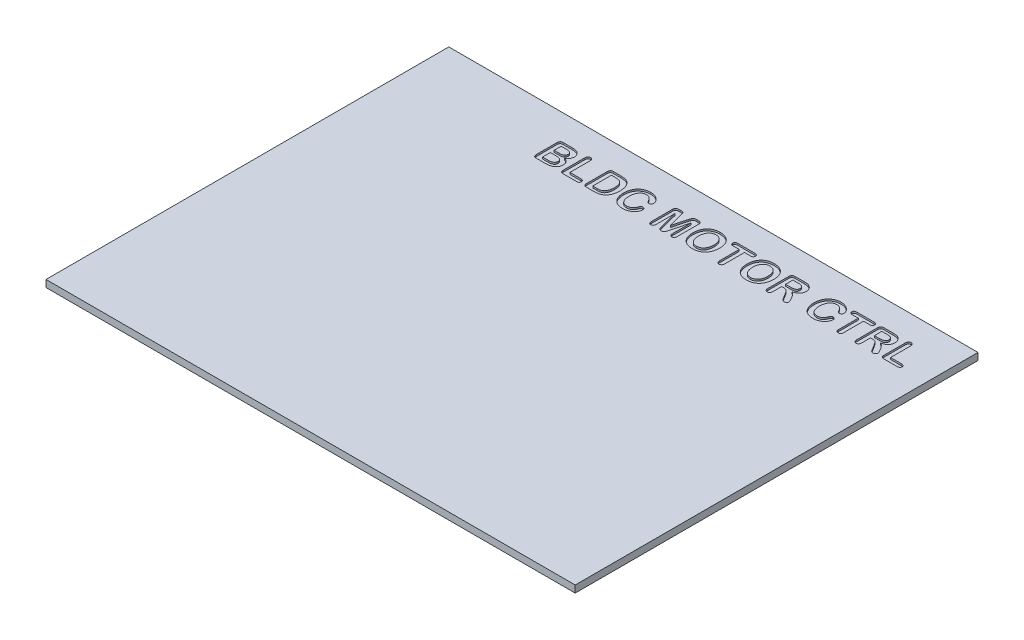
from build123d import *

# Parameters (mm, degrees)
SKETCH1_W           = 150.7
SKETCH1_H           = 114.7
BOSS_EXTRUDE1_DEPTH = 2
CUT_EXTRUDE1_DEPTH  = 0.5


with BuildPart() as part:
    # Sketch1 → Boss-Extrude1 (new body)
    with BuildSketch(Plane(origin=(0, 0, 0), x_dir=(1, 0, 0), z_dir=(0, 1, 0))):
        Rectangle(SKETCH1_W, SKETCH1_H)
    extrude(amount=BOSS_EXTRUDE1_DEPTH)

    # Sketch2 → Cut-Extrude1 (cut)
    # profile 1 of 13: a face of its own
    with BuildSketch(Plane(origin=(0, 2, 0), x_dir=(1, 0, 0), z_dir=(0, 1, 0))):
        with BuildLine():
            Line((64.15, 49.296875), (64.15, 43.65))
            Line((64.15, 43.65), (67.325, 43.65))
            add(Edge.make_bspline(
                [(67.325, 43.65), (67.384606363, 43.648439573), (67.49827203, 43.645463936), (67.657187979, 43.608679827), (67.796410249, 43.551765147), (67.908976147, 43.4671283), (67.9997075, 43.368133823), (68.065603626, 43.254905648), (68.10414737, 43.128489467), (68.108640381, 43.04036663), (68.1109375, 42.9953125)],
                knots=[0, 0, 0, 0, 1.240270116, 2.365118784, 3.381765818, 4.352609133, 5.275186246, 6.165500839, 7.062084633, 8, 8, 8, 8], degree=3))
            add(Edge.make_bspline(
                [(68.1109375, 42.9953125), (68.10873389, 42.94920294), (68.104471254, 42.86000921), (68.065557549, 42.732620709), (68.000443082, 42.620241591), (67.910861828, 42.523340405), (67.798436384, 42.443245732), (67.65984972, 42.390063447), (67.500216604, 42.354634728), (67.385639331, 42.351603997), (67.325, 42.35)],
                knots=[0, 0, 0, 0, 0.961785517, 1.860465312, 2.752861249, 3.654173772, 4.599371787, 5.609990076, 6.735101654, 8, 8, 8, 8], degree=3))
            Line((67.325, 42.35), (63.56875, 42.35))
            add(Edge.make_bspline(
                [(63.56875, 42.35), (63.49241766, 42.351997183), (63.350257697, 42.3557167), (63.154183221, 42.400408251), (62.989340792, 42.468932664), (62.85799731, 42.573082985), (62.76119177, 42.711813437), (62.69494922, 42.883053388), (62.657501621, 43.087984453), (62.652615028, 43.235252813), (62.65, 43.3140625)],
                knots=[0, 0, 0, 0, 1.184943227, 2.206816713, 3.109923682, 3.939837529, 4.776053014, 5.71019795, 6.774627611, 8, 8, 8, 8], degree=3))
            Line((62.65, 43.3140625), (62.65, 49.296875))
            add(Edge.make_bspline(
                [(62.65, 49.296875), (62.651932691, 49.371549514), (62.655572335, 49.512176546), (62.694339579, 49.708149319), (62.758167302, 49.875207879), (62.848037914, 50.01275996), (62.960951705, 50.11881707), (63.090139139, 50.196374982), (63.236749951, 50.241028083), (63.339283204, 50.246946343), (63.3921875, 50.25)],
                knots=[0, 0, 0, 0, 1.312227502, 2.471186598, 3.495416453, 4.440711492, 5.33513045, 6.197779038, 7.0701043, 8, 8, 8, 8], degree=3))
            add(Edge.make_bspline(
                [(63.3921875, 50.25), (63.446217372, 50.247815892), (63.551154323, 50.243573911), (63.69952561, 50.195531105), (63.832600197, 50.121409848), (63.946888948, 50.015500192), (64.041303829, 49.880024327), (64.105510341, 49.711851043), (64.144632881, 49.514302002), (64.148130611, 49.3726057), (64.15, 49.296875)],
                knots=[0, 0, 0, 0, 0.937651975, 1.821110013, 2.686129292, 3.571911612, 4.510265029, 5.535848738, 6.683015045, 8, 8, 8, 8], degree=3))
        make_face()
    # profile 2 of 13: a face of its own
    with BuildSketch(Plane(origin=(0, 2, 0), x_dir=(1, 0, 0), z_dir=(0, 1, 0))):
        with BuildLine():
            Line((56.990625, 45.65), (56.45, 45.65))
            Line((56.45, 45.65), (56.45, 43.19375))
            add(Edge.make_bspline(
                [(56.45, 43.19375), (56.448096592, 43.118036714), (56.44453521, 42.976372994), (56.40592185, 42.779087942), (56.340939828, 42.612697985), (56.249114691, 42.478089841), (56.135320699, 42.376111968), (56.005495892, 42.302279275), (55.859177287, 42.257079403), (55.756053039, 42.252401111), (55.703125, 42.25)],
                knots=[0, 0, 0, 0, 1.331902197, 2.492062242, 3.520752585, 4.456973203, 5.333663409, 6.188000262, 7.069999586, 8, 8, 8, 8], degree=3))
            add(Edge.make_bspline(
                [(55.703125, 42.25), (55.646559233, 42.252870585), (55.537692418, 42.258395331), (55.384378435, 42.304237005), (55.251971433, 42.381842038), (55.140161652, 42.488642128), (55.053397426, 42.626684386), (54.993640626, 42.792943163), (54.955875984, 42.985821506), (54.952035548, 43.123762216), (54.95, 43.196875)],
                knots=[0, 0, 0, 0, 0.98783513, 1.901193439, 2.76656523, 3.649069121, 4.578809423, 5.590416226, 6.722847106, 8, 8, 8, 8], degree=3))
            Line((54.95, 43.196875), (54.95, 49.0984375))
            add(Edge.make_bspline(
                [(54.95, 49.0984375), (54.95228991, 49.176267709), (54.956586623, 49.322305742), (54.998247097, 49.524345325), (55.065988857, 49.694003921), (55.16617733, 49.830484722), (55.3010289, 49.932347818), (55.468532889, 50.0019088), (55.668832048, 50.043457737), (55.813320254, 50.047719729), (55.890625, 50.05)],
                knots=[0, 0, 0, 0, 1.204539147, 2.260157444, 3.178834964, 4.014831347, 4.849268471, 5.763683293, 6.803515522, 8, 8, 8, 8], degree=3))
            Line((55.890625, 50.05), (58.384375, 50.05))
            add(Edge.make_bspline(
                [(58.384375, 50.05), (58.46718904, 50.049241289), (58.626605219, 50.047780777), (58.85701692, 50.041122713), (59.068508135, 50.024866614), (59.263554693, 50.00497796), (59.444721841, 49.978334009), (59.614561151, 49.936352071), (59.776378601, 49.886469062), (59.877994813, 49.841121333), (59.928125, 49.81875)],
                knots=[0, 0, 0, 0, 1.26312999, 2.431512321, 3.514756431, 4.497259456, 5.421894158, 6.30431173, 7.16346842, 8, 8, 8, 8], degree=3))
            add(Edge.make_bspline(
                [(59.928125, 49.81875), (59.988110007, 49.791823841), (60.107384229, 49.738283852), (60.27561674, 49.636538884), (60.43360203, 49.519869576), (60.578765557, 49.386055946), (60.712232078, 49.240678272), (60.825981306, 49.079440216), (60.925315873, 48.908884291), (61.006502129, 48.726957248), (61.069751509, 48.536772717), (61.117914802, 48.340545389), (61.144130303, 48.138215137), (61.148033408, 48.001630894), (61.15, 47.9328125)],
                knots=[0, 0, 0, 0, 0.991101386, 1.970706541, 2.959125982, 3.949043219, 4.94477413, 5.930285116, 6.919453739, 7.918248778, 8.929482208, 9.939493973, 10.961807665, 12, 12, 12, 12], degree=3))
            add(Edge.make_bspline(
                [(61.15, 47.9328125), (61.148608958, 47.862947365), (61.145891299, 47.72645288), (61.121524154, 47.527432164), (61.084414518, 47.338614016), (61.032375496, 47.159935063), (60.960352848, 46.993382569), (60.876792392, 46.8367998), (60.776956322, 46.690959171), (60.661042601, 46.556409395), (60.528651042, 46.432958878), (60.381840548, 46.317863911), (60.21960645, 46.211632575), (60.040235974, 46.116742544), (59.845611974, 46.030214442), (59.634525431, 45.955314046), (59.408946761, 45.884605913), (59.25134595, 45.84936816), (59.1703125, 45.83125)],
                knots=[0, 0, 0, 0, 1.055142993, 2.061417327, 3.024364171, 3.960444909, 4.866579139, 5.760848635, 6.638237999, 7.530982974, 8.438346324, 9.368654669, 10.346405169, 11.363786046, 12.431180916, 13.561267985, 14.746079633, 16, 16, 16, 16], degree=3))
            add(Edge.make_bspline(
                [(59.1703125, 45.83125), (59.240563627, 45.79216374), (59.383809297, 45.71246484), (59.585394024, 45.560309762), (59.784591723, 45.385967451), (59.973614673, 45.183937468), (60.157272114, 44.96853653), (60.334654235, 44.745285024), (60.500085596, 44.514015546), (60.652553084, 44.278296191), (60.793594774, 44.046621457), (60.919104822, 43.823247047), (61.02670385, 43.610679944), (61.118136097, 43.413266465), (61.190966948, 43.237073073), (61.242854867, 43.087946522), (61.27771528, 42.969725921), (61.284615789, 42.899616279), (61.2875, 42.8703125)],
                knots=[0, 0, 0, 0, 1.03513849, 2.110700756, 3.247524223, 4.444168505, 5.672631725, 6.896242247, 8.11841533, 9.33624741, 10.514118669, 11.614189172, 12.638032039, 13.584270828, 14.418327787, 15.09350525, 15.621111712, 16, 16, 16, 16], degree=3))
            add(Edge.make_bspline(
                [(61.2875, 42.8703125), (61.28216706, 42.819526922), (61.270977138, 42.712965308), (61.206121941, 42.590214673), (61.137503828, 42.499137373), (61.075857923, 42.434970428), (61.003391772, 42.381084969), (60.923570439, 42.333725298), (60.835936767, 42.296069948), (60.740729963, 42.270037106), (60.639247305, 42.251658423), (60.568836881, 42.250561317), (60.5328125, 42.25)],
                knots=[0, 0, 0, 0, 1.406975553, 2.952207972, 3.767564478, 4.575194754, 5.410805362, 6.266190622, 7.146975177, 8.048514508, 9.001553276, 10, 10, 10, 10], degree=3))
            add(Edge.make_bspline(
                [(60.5328125, 42.25), (60.490485126, 42.251315718), (60.40877682, 42.253855566), (60.291741207, 42.278598514), (60.183987433, 42.314979582), (60.056309797, 42.388025635), (59.915543649, 42.507570262), (59.796271861, 42.655016491), (59.704281309, 42.794375384), (59.624110257, 42.922491172), (59.529132112, 43.070883733), (59.464308483, 43.178475124), (59.4296875, 43.2359375)],
                knots=[0, 0, 0, 0, 0.811939239, 1.567358733, 2.288822191, 2.987519458, 4.379962622, 5.808282274, 6.615771143, 7.58722562, 8.711386222, 10, 10, 10, 10], degree=3))
            Line((59.4296875, 43.2359375), (58.8015625, 44.26875))
            add(Edge.make_bspline(
                [(58.8015625, 44.26875), (58.748007762, 44.35818697), (58.64673237, 44.52731793), (58.494041277, 44.76110198), (58.348618902, 44.959997123), (58.211932578, 45.128426016), (58.079109582, 45.26892008), (57.946587895, 45.384587508), (57.81089551, 45.474106418), (57.672928428, 45.544403547), (57.52468186, 45.593009798), (57.362279385, 45.627001811), (57.182277676, 45.647128439), (57.056303361, 45.649015931), (56.990625, 45.65)],
                knots=[0, 0, 0, 0, 1.54923933, 2.929709427, 4.148172657, 5.209662816, 6.151357592, 7.018659628, 7.817301611, 8.561575462, 9.313059885, 10.128334294, 11.024182546, 12, 12, 12, 12], degree=3))
        make_face()
        with BuildLine():
            Line((57.875, 48.85), (56.45, 48.85))
            Line((56.45, 48.85), (56.45, 46.75))
            Line((56.45, 46.75), (57.8328125, 46.75))
            add(Edge.make_bspline(
                [(57.8328125, 46.75), (57.921899714, 46.75127689), (58.093478111, 46.753736128), (58.339279629, 46.770141678), (58.563286748, 46.799628735), (58.76476735, 46.840836644), (58.946025907, 46.895426078), (59.102718654, 46.97172563), (59.240663201, 47.060025032), (59.353492411, 47.170076165), (59.444207181, 47.299663417), (59.505634711, 47.452455705), (59.543901555, 47.625728112), (59.547901064, 47.748217654), (59.55, 47.8125)],
                knots=[0, 0, 0, 0, 1.392051732, 2.681035748, 3.846991481, 4.919597892, 5.892539963, 6.795281946, 7.634960986, 8.440706374, 9.24212453, 10.088520951, 10.996858383, 12, 12, 12, 12], degree=3))
            add(Edge.make_bspline(
                [(59.55, 47.8125), (59.548571566, 47.864245705), (59.545773106, 47.965621295), (59.512893031, 48.11176513), (59.462684784, 48.24889335), (59.392019138, 48.374943888), (59.304705882, 48.490348336), (59.198568342, 48.588530748), (59.078462733, 48.674059315), (58.988308193, 48.714995582), (58.9421875, 48.7359375)],
                knots=[0, 0, 0, 0, 1.054557985, 2.06599635, 3.041648879, 4.026871944, 5.005128146, 5.982979788, 6.968145478, 8, 8, 8, 8], degree=3))
            add(Edge.make_bspline(
                [(58.9421875, 48.7359375), (58.916803692, 48.74521542), (58.861625573, 48.765383323), (58.768522357, 48.788464852), (58.659085095, 48.805690213), (58.534253115, 48.823741155), (58.392893521, 48.835819414), (58.23493044, 48.84240535), (58.060480227, 48.849815464), (57.938551374, 48.849936772), (57.875, 48.85)],
                knots=[0, 0, 0, 0, 0.601274756, 1.307022564, 2.130372336, 3.066540635, 4.11402688, 5.286356465, 6.585603249, 8, 8, 8, 8], degree=3))
        make_face(mode=Mode.SUBTRACT)
    # profile 3 of 13: a face of its own
    with BuildSketch(Plane(origin=(0, 2, 0), x_dir=(1, 0, 0), z_dir=(0, 1, 0))):
        with BuildLine():
            Line((53.0578125, 48.75), (51.35, 48.75))
            Line((51.35, 48.75), (51.35, 43.19375))
            add(Edge.make_bspline(
                [(51.35, 43.19375), (51.348148683, 43.118535681), (51.344686184, 42.97786313), (51.305288163, 42.781404942), (51.241477772, 42.614492132), (51.148549707, 42.479737946), (51.035904267, 42.375968674), (50.905825861, 42.302721538), (50.76031622, 42.256840006), (50.657641248, 42.252327359), (50.6046875, 42.25)],
                knots=[0, 0, 0, 0, 1.324771526, 2.4777063, 3.516495944, 4.454151167, 5.338361256, 6.19400724, 7.068574513, 8, 8, 8, 8], degree=3))
            add(Edge.make_bspline(
                [(50.6046875, 42.25), (50.551142683, 42.252124623), (50.44715597, 42.256250747), (50.300563979, 42.305181765), (50.166914435, 42.376697952), (50.053295254, 42.483117179), (49.958625993, 42.617658023), (49.896912448, 42.785554926), (49.854827435, 42.97968454), (49.851673905, 43.119523156), (49.85, 43.19375)],
                knots=[0, 0, 0, 0, 0.936591527, 1.818907611, 2.686883908, 3.580272073, 4.52668274, 5.549195867, 6.699104295, 8, 8, 8, 8], degree=3))
            Line((49.85, 43.19375), (49.85, 48.75))
            Line((49.85, 48.75), (48.140625, 48.75))
            add(Edge.make_bspline(
                [(48.140625, 48.75), (48.077905618, 48.751556279), (47.960231213, 48.754476178), (47.796906818, 48.789852284), (47.656740423, 48.842988626), (47.543325711, 48.922921396), (47.456539538, 49.021221203), (47.39315205, 49.133869266), (47.357079634, 49.261375609), (47.352406376, 49.350818595), (47.35, 49.396875)],
                knots=[0, 0, 0, 0, 1.298175259, 2.435642608, 3.448405227, 4.386245553, 5.281324188, 6.14672195, 7.045701294, 8, 8, 8, 8], degree=3))
            add(Edge.make_bspline(
                [(47.35, 49.396875), (47.352003331, 49.445113421), (47.355866362, 49.538131793), (47.39667311, 49.668486726), (47.460181417, 49.783764012), (47.551502619, 49.879883878), (47.666220724, 49.95798555), (47.805087679, 50.011772948), (47.965644078, 50.044805548), (48.080029663, 50.048201178), (48.140625, 50.05)],
                knots=[0, 0, 0, 0, 0.993926626, 1.916593339, 2.793690024, 3.692250099, 4.629614642, 5.63892321, 6.749228366, 8, 8, 8, 8], degree=3))
            Line((48.140625, 50.05), (53.0578125, 50.05))
            add(Edge.make_bspline(
                [(53.0578125, 50.05), (53.121559191, 50.048386745), (53.24126913, 50.045357212), (53.407509792, 50.01065929), (53.549519021, 49.955899164), (53.662318061, 49.873323553), (53.752113655, 49.77610947), (53.813727111, 49.661365636), (53.853058231, 49.533799084), (53.857222549, 49.443532148), (53.859375, 49.396875)],
                knots=[0, 0, 0, 0, 1.304496451, 2.449714448, 3.464685333, 4.39788137, 5.28974218, 6.154486031, 7.046091257, 8, 8, 8, 8], degree=3))
            add(Edge.make_bspline(
                [(53.859375, 49.396875), (53.857109889, 49.350784207), (53.852703748, 49.261127431), (53.814520318, 49.133710702), (53.749633141, 49.021124348), (53.661248062, 48.922855601), (53.546290994, 48.842994176), (53.404147791, 48.789615927), (53.239182525, 48.754757885), (53.120516423, 48.751644914), (53.0578125, 48.75)],
                knots=[0, 0, 0, 0, 0.94771637, 1.843517728, 2.708217129, 3.604275273, 4.544436114, 5.560171289, 6.710778986, 8, 8, 8, 8], degree=3))
        make_face()
    # profile 4 of 13: a face of its own
    with BuildSketch(Plane(origin=(0, 2, 0), x_dir=(1, 0, 0), z_dir=(0, 1, 0))):
        with BuildLine():
            add(Edge.make_bspline(
                [(46.6546875, 44.8015625), (46.652565167, 44.739434039), (46.648183133, 44.611155882), (46.611329804, 44.416023972), (46.5548893, 44.213001422), (46.474637488, 44.00444678), (46.372718614, 43.791717623), (46.240596993, 43.581422007), (46.084238216, 43.372084589), (45.902210056, 43.166306528), (45.694191225, 42.970972342), (45.456434568, 42.794475875), (45.192329245, 42.637559958), (44.902216716, 42.499333481), (44.586268231, 42.385678961), (44.242659794, 42.307559493), (43.874895047, 42.257882307), (43.621001567, 42.252674338), (43.490625, 42.25)],
                knots=[0, 0, 0, 0, 0.663733519, 1.370426865, 2.116139696, 2.914458905, 3.756161797, 4.633801399, 5.564768272, 6.546895284, 7.567232022, 8.609557965, 9.705783212, 10.846455846, 12.040496113, 13.287086875, 14.606894913, 16, 16, 16, 16], degree=3))
            add(Edge.make_bspline(
                [(43.490625, 42.25), (43.39109585, 42.25083629), (43.196468083, 42.252471641), (42.911310532, 42.275896715), (42.63940779, 42.309195772), (42.380781505, 42.357081421), (42.134949359, 42.421757045), (41.901106294, 42.501284584), (41.677406092, 42.594893939), (41.465672454, 42.706253793), (41.26383905, 42.836005763), (41.070624301, 42.982819015), (40.884042972, 43.14740523), (40.770321255, 43.270318065), (40.7125, 43.3328125)],
                knots=[0, 0, 0, 0, 1.162398207, 2.273052359, 3.340187725, 4.361698781, 5.343118899, 6.307107414, 7.245071305, 8.173155143, 9.098082292, 10.044846171, 11.00591152, 12, 12, 12, 12], degree=3))
            add(Edge.make_bspline(
                [(40.7125, 43.3328125), (40.662285864, 43.395265356), (40.561638465, 43.520443602), (40.423135895, 43.719656821), (40.299651648, 43.931556665), (40.182291267, 44.151182227), (40.082090634, 44.382831503), (39.992712683, 44.62146405), (39.917054113, 44.868174399), (39.857158285, 45.123114627), (39.807467139, 45.385147852), (39.776638394, 45.655728135), (39.752502971, 45.932901379), (39.750839696, 46.12077694), (39.75, 46.215625)],
                knots=[0, 0, 0, 0, 0.929575355, 1.863207229, 2.811429804, 3.773642551, 4.750392879, 5.73698116, 6.729013264, 7.741753443, 8.774044155, 9.821085133, 10.899985467, 12, 12, 12, 12], degree=3))
            add(Edge.make_bspline(
                [(39.75, 46.215625), (39.753071926, 46.368392949), (39.759066505, 46.666505471), (39.812350381, 47.100743017), (39.89496988, 47.511400328), (40.015863574, 47.896228753), (40.16814529, 48.25593765), (40.348448769, 48.590074859), (40.56189367, 48.895678539), (40.802174951, 49.173845714), (41.068538734, 49.422810736), (41.356854654, 49.641089623), (41.667197706, 49.826612106), (41.997231769, 49.979727145), (42.343698763, 50.098902736), (42.70208477, 50.187793981), (43.07188386, 50.240135726), (43.322233012, 50.246693922), (43.4484375, 50.25)],
                knots=[0, 0, 0, 0, 1.192086909, 2.32624733, 3.409866705, 4.457877143, 5.469000883, 6.455088314, 7.416011801, 8.372962001, 9.319325461, 10.256879636, 11.190511563, 12.136385829, 13.091719595, 14.046248446, 15.015086683, 16, 16, 16, 16], degree=3))
            add(Edge.make_bspline(
                [(43.4484375, 50.25), (43.525548885, 50.248679161), (43.67787868, 50.246069908), (43.903306439, 50.228961362), (44.122303949, 50.19901172), (44.335106596, 50.158361096), (44.541579477, 50.107514062), (44.741278909, 50.042636191), (44.934458272, 49.966609546), (45.119969495, 49.878451815), (45.297556301, 49.784012028), (45.464532058, 49.682107895), (45.621717597, 49.57616384), (45.767355261, 49.462870095), (45.903226621, 49.345182877), (46.026843596, 49.220414188), (46.142046572, 49.092733353), (46.243803923, 48.95839319), (46.336125841, 48.823916371), (46.414287163, 48.688534149), (46.481194167, 48.555888016), (46.539277061, 48.425914839), (46.580877909, 48.296249466), (46.610594339, 48.168693708), (46.63074408, 48.043344103), (46.633173773, 47.959969785), (46.634375, 47.91875)],
                knots=[0, 0, 0, 0, 1.284700242, 2.537862918, 3.763812693, 4.965289083, 6.145935712, 7.303948861, 8.460888676, 9.602102237, 10.724019168, 11.810373379, 12.859709494, 13.88027226, 14.88267171, 15.852117704, 16.804758353, 17.745428632, 18.657571087, 19.520770973, 20.347343408, 21.132381758, 21.889741149, 22.611674871, 23.313620019, 24, 24, 24, 24], degree=3))
            add(Edge.make_bspline(
                [(46.634375, 47.91875), (46.631747056, 47.875327196), (46.62656496, 47.789700907), (46.591789603, 47.66437049), (46.528357462, 47.549728266), (46.4469667, 47.444350907), (46.348231841, 47.355664686), (46.236811099, 47.290194199), (46.11487155, 47.248400046), (46.029503893, 47.244286699), (45.9859375, 47.2421875)],
                knots=[0, 0, 0, 0, 1.005202555, 1.982178884, 2.979908251, 4.019228851, 5.052378826, 6.030321538, 6.994797445, 8, 8, 8, 8], degree=3))
            add(Edge.make_bspline(
                [(45.9859375, 47.2421875), (45.93894404, 47.243959359), (45.849849954, 47.247318596), (45.725013223, 47.272836036), (45.618886301, 47.318480346), (45.52888255, 47.38514917), (45.451598015, 47.477190656), (45.370901339, 47.589922123), (45.284775217, 47.728257793), (45.229588796, 47.830903106), (45.2, 47.8859375)],
                knots=[0, 0, 0, 0, 1.03602979, 1.964190893, 2.792215287, 3.564084538, 4.410155262, 5.430272824, 6.62221301, 8, 8, 8, 8], degree=3))
            add(Edge.make_bspline(
                [(45.2, 47.8859375), (45.148796852, 47.978262308), (45.05001571, 48.15637538), (44.875789543, 48.395385769), (44.687772081, 48.59736106), (44.485078824, 48.764185769), (44.261543559, 48.893357735), (44.015492214, 48.986469877), (43.744411041, 49.039219667), (43.556477744, 49.046327482), (43.459375, 49.05)],
                knots=[0, 0, 0, 0, 1.14083101, 2.200891824, 3.189077095, 4.117958574, 5.028926365, 5.968284059, 6.950238216, 8, 8, 8, 8], degree=3))
            add(Edge.make_bspline(
                [(43.459375, 49.05), (43.381087956, 49.048283782), (43.227290247, 49.044912209), (43.003281667, 49.006998271), (42.79088663, 48.950567892), (42.591496201, 48.867339479), (42.403429945, 48.763251191), (42.228571534, 48.633417989), (42.066913401, 48.480068513), (41.916828702, 48.305266202), (41.782601928, 48.108278778), (41.667175512, 47.890905562), (41.56774657, 47.655363322), (41.489645932, 47.398874542), (41.424217561, 47.123671745), (41.382623042, 46.827581575), (41.355249566, 46.513017397), (41.351781534, 46.296937882), (41.35, 46.1859375)],
                knots=[0, 0, 0, 0, 0.93671651, 1.840213212, 2.713397844, 3.56368846, 4.421020421, 5.281885359, 6.164466969, 7.084649485, 8.036264718, 9.013062724, 10.027939462, 11.093339593, 12.220621858, 13.412469407, 14.670781518, 16, 16, 16, 16], degree=3))
            add(Edge.make_bspline(
                [(41.35, 46.1859375), (41.351147268, 46.110928199), (41.353387222, 45.964478292), (41.363671979, 45.749108732), (41.383967159, 45.54370466), (41.412633062, 45.347871534), (41.44589333, 45.161294388), (41.489754042, 44.985035614), (41.541834953, 44.818264636), (41.600091333, 44.660659575), (41.668891812, 44.513648848), (41.739288193, 44.374015791), (41.819063915, 44.24521883), (41.907934849, 44.128349555), (41.999513031, 44.017644736), (42.099499949, 43.917849638), (42.206487454, 43.828383926), (42.356731711, 43.7218947), (42.560263281, 43.612063513), (42.824621606, 43.517680814), (43.108971635, 43.459994099), (43.305453048, 43.453388658), (43.40625, 43.45)],
                knots=[0, 0, 0, 0, 1.161576005, 2.267888061, 3.337585273, 4.356077319, 5.33204537, 6.270922222, 7.166254778, 8.036538097, 8.870177389, 9.678142996, 10.45692397, 11.2117863, 11.950096439, 12.68003429, 13.395618977, 14.107193223, 15.528992878, 16.960094082, 18.440497528, 20, 20, 20, 20], degree=3))
            add(Edge.make_bspline(
                [(43.40625, 43.45), (43.461514711, 43.450576426), (43.570245611, 43.45171052), (43.729335459, 43.470235871), (43.882518733, 43.496138093), (44.02857373, 43.533960042), (44.169335097, 43.580143777), (44.301851819, 43.64055745), (44.42929569, 43.709114245), (44.549891522, 43.788743818), (44.662502132, 43.880226344), (44.76885893, 43.980631202), (44.869854998, 44.089471651), (44.959791761, 44.211250192), (45.044915688, 44.341365667), (45.122600359, 44.481868611), (45.193434658, 44.632083187), (45.233011647, 44.737202497), (45.253125, 44.790625)],
                knots=[0, 0, 0, 0, 1.080453892, 2.125745732, 3.129130718, 4.117609764, 5.07455133, 6.023212249, 6.962414916, 7.903439618, 8.845456672, 9.796903999, 10.763291339, 11.745501622, 12.754406698, 13.803416246, 14.883677954, 16, 16, 16, 16], degree=3))
            add(Edge.make_bspline(
                [(45.253125, 44.790625), (45.270082545, 44.840385886), (45.302841428, 44.936514843), (45.362242561, 45.070679224), (45.426772684, 45.190423664), (45.495625145, 45.298194505), (45.583209839, 45.387942537), (45.694697816, 45.451900701), (45.828635795, 45.487247953), (45.92426561, 45.491496188), (45.975, 45.49375)],
                knots=[0, 0, 0, 0, 1.148264852, 2.218238262, 3.200956292, 4.119438462, 5.004604087, 5.912235567, 6.892380428, 8, 8, 8, 8], degree=3))
            add(Edge.make_bspline(
                [(45.975, 45.49375), (46.020095873, 45.491508654), (46.108800192, 45.487099889), (46.235908953, 45.447169172), (46.354523131, 45.386116181), (46.457166145, 45.297740054), (46.545606316, 45.194465094), (46.60912, 45.074502015), (46.648136483, 44.941988), (46.652463654, 44.849232148), (46.6546875, 44.8015625)],
                knots=[0, 0, 0, 0, 1.000050397, 1.967115494, 2.935635085, 3.946684534, 4.957733984, 5.941906876, 6.942292355, 8, 8, 8, 8], degree=3))
        make_face()
    # profile 5 of 13: a face of its own
    with BuildSketch(Plane(origin=(0, 2, 0), x_dir=(1, 0, 0), z_dir=(0, 1, 0))):
        with BuildLine():
            Line((31.690625, 45.65), (31.15, 45.65))
            Line((31.15, 45.65), (31.15, 43.19375))
            add(Edge.make_bspline(
                [(31.15, 43.19375), (31.148096592, 43.118036714), (31.14453521, 42.976372994), (31.10592185, 42.779087942), (31.040939828, 42.612697985), (30.949114691, 42.478089841), (30.835320699, 42.376111968), (30.705495892, 42.302279275), (30.559177287, 42.257079403), (30.456053039, 42.252401111), (30.403125, 42.25)],
                knots=[0, 0, 0, 0, 1.331902197, 2.492062242, 3.520752585, 4.456973203, 5.333663409, 6.188000262, 7.069999586, 8, 8, 8, 8], degree=3))
            add(Edge.make_bspline(
                [(30.403125, 42.25), (30.346559233, 42.252870585), (30.237692418, 42.258395331), (30.084378435, 42.304237005), (29.951971433, 42.381842038), (29.840161652, 42.488642128), (29.753397426, 42.626684386), (29.693640626, 42.792943163), (29.655875984, 42.985821506), (29.652035548, 43.123762216), (29.65, 43.196875)],
                knots=[0, 0, 0, 0, 0.98783513, 1.901193439, 2.76656523, 3.649069121, 4.578809423, 5.590416226, 6.722847106, 8, 8, 8, 8], degree=3))
            Line((29.65, 43.196875), (29.65, 49.0984375))
            add(Edge.make_bspline(
                [(29.65, 49.0984375), (29.65228991, 49.176267709), (29.656586623, 49.322305742), (29.698247097, 49.524345325), (29.765988857, 49.694003921), (29.86617733, 49.830484722), (30.0010289, 49.932347818), (30.168532889, 50.0019088), (30.368832048, 50.043457737), (30.513320254, 50.047719729), (30.590625, 50.05)],
                knots=[0, 0, 0, 0, 1.204539147, 2.260157444, 3.178834964, 4.014831347, 4.849268471, 5.763683293, 6.803515522, 8, 8, 8, 8], degree=3))
            Line((30.590625, 50.05), (33.084375, 50.05))
            add(Edge.make_bspline(
                [(33.084375, 50.05), (33.16718904, 50.049241289), (33.326605219, 50.047780777), (33.55701692, 50.041122713), (33.768508135, 50.024866614), (33.963554693, 50.00497796), (34.144721841, 49.978334009), (34.314561151, 49.936352071), (34.476378601, 49.886469062), (34.577994813, 49.841121333), (34.628125, 49.81875)],
                knots=[0, 0, 0, 0, 1.26312999, 2.431512321, 3.514756431, 4.497259456, 5.421894158, 6.30431173, 7.16346842, 8, 8, 8, 8], degree=3))
            add(Edge.make_bspline(
                [(34.628125, 49.81875), (34.688110007, 49.791823841), (34.807384229, 49.738283852), (34.97561674, 49.636538884), (35.13360203, 49.519869576), (35.278765557, 49.386055946), (35.412232078, 49.240678272), (35.525981306, 49.079440216), (35.625315873, 48.908884291), (35.706502129, 48.726957248), (35.769751509, 48.536772717), (35.817914802, 48.340545389), (35.844130303, 48.138215137), (35.848033408, 48.001630894), (35.85, 47.9328125)],
                knots=[0, 0, 0, 0, 0.991101386, 1.970706541, 2.959125982, 3.949043219, 4.94477413, 5.930285116, 6.919453739, 7.918248778, 8.929482208, 9.939493973, 10.961807665, 12, 12, 12, 12], degree=3))
            add(Edge.make_bspline(
                [(35.85, 47.9328125), (35.848608958, 47.862947365), (35.845891299, 47.72645288), (35.821524154, 47.527432164), (35.784414518, 47.338614016), (35.732375496, 47.159935063), (35.660352848, 46.993382569), (35.576792392, 46.8367998), (35.476956322, 46.690959171), (35.361042601, 46.556409395), (35.228651042, 46.432958878), (35.081840548, 46.317863911), (34.91960645, 46.211632575), (34.740235974, 46.116742544), (34.545611974, 46.030214442), (34.334525431, 45.955314046), (34.108946761, 45.884605913), (33.95134595, 45.84936816), (33.8703125, 45.83125)],
                knots=[0, 0, 0, 0, 1.055142993, 2.061417327, 3.024364171, 3.960444909, 4.866579139, 5.760848635, 6.638237999, 7.530982974, 8.438346324, 9.368654669, 10.346405169, 11.363786046, 12.431180916, 13.561267985, 14.746079633, 16, 16, 16, 16], degree=3))
            add(Edge.make_bspline(
                [(33.8703125, 45.83125), (33.940563627, 45.79216374), (34.083809297, 45.71246484), (34.285394024, 45.560309762), (34.484591723, 45.385967451), (34.673614673, 45.183937468), (34.857272114, 44.96853653), (35.034654235, 44.745285024), (35.200085596, 44.514015546), (35.352553084, 44.278296191), (35.493594774, 44.046621457), (35.619104822, 43.823247047), (35.72670385, 43.610679944), (35.818136097, 43.413266465), (35.890966948, 43.237073073), (35.942854867, 43.087946522), (35.97771528, 42.969725921), (35.984615789, 42.899616279), (35.9875, 42.8703125)],
                knots=[0, 0, 0, 0, 1.03513849, 2.110700756, 3.247524223, 4.444168505, 5.672631725, 6.896242247, 8.11841533, 9.33624741, 10.514118669, 11.614189172, 12.638032039, 13.584270828, 14.418327787, 15.09350525, 15.621111712, 16, 16, 16, 16], degree=3))
            add(Edge.make_bspline(
                [(35.9875, 42.8703125), (35.98216706, 42.819526922), (35.970977138, 42.712965308), (35.906121941, 42.590214673), (35.837503828, 42.499137373), (35.775857923, 42.434970428), (35.703391772, 42.381084969), (35.623570439, 42.333725298), (35.535936767, 42.296069948), (35.440729963, 42.270037106), (35.339247305, 42.251658423), (35.268836881, 42.250561317), (35.2328125, 42.25)],
                knots=[0, 0, 0, 0, 1.406975553, 2.952207972, 3.767564478, 4.575194754, 5.410805362, 6.266190622, 7.146975177, 8.048514508, 9.001553276, 10, 10, 10, 10], degree=3))
            add(Edge.make_bspline(
                [(35.2328125, 42.25), (35.190485126, 42.251315718), (35.10877682, 42.253855566), (34.991741207, 42.278598514), (34.883987433, 42.314979582), (34.756309797, 42.388025635), (34.615543649, 42.507570262), (34.496271861, 42.655016491), (34.404281309, 42.794375384), (34.324110257, 42.922491172), (34.229132112, 43.070883733), (34.164308483, 43.178475124), (34.1296875, 43.2359375)],
                knots=[0, 0, 0, 0, 0.811939239, 1.567358733, 2.288822191, 2.987519458, 4.379962622, 5.808282274, 6.615771143, 7.58722562, 8.711386222, 10, 10, 10, 10], degree=3))
            Line((34.1296875, 43.2359375), (33.5015625, 44.26875))
            add(Edge.make_bspline(
                [(33.5015625, 44.26875), (33.448007762, 44.35818697), (33.34673237, 44.52731793), (33.194041277, 44.76110198), (33.048618902, 44.959997123), (32.911932578, 45.128426016), (32.779109582, 45.26892008), (32.646587895, 45.384587508), (32.51089551, 45.474106418), (32.372928428, 45.544403547), (32.22468186, 45.593009798), (32.062279385, 45.627001811), (31.882277676, 45.647128439), (31.756303361, 45.649015931), (31.690625, 45.65)],
                knots=[0, 0, 0, 0, 1.54923933, 2.929709427, 4.148172657, 5.209662816, 6.151357592, 7.018659628, 7.817301611, 8.561575462, 9.313059885, 10.128334294, 11.024182546, 12, 12, 12, 12], degree=3))
        make_face()
        with BuildLine():
            Line((32.575, 48.85), (31.15, 48.85))
            Line((31.15, 48.85), (31.15, 46.75))
            Line((31.15, 46.75), (32.5328125, 46.75))
            add(Edge.make_bspline(
                [(32.5328125, 46.75), (32.621899714, 46.75127689), (32.793478111, 46.753736128), (33.039279629, 46.770141678), (33.263286748, 46.799628735), (33.46476735, 46.840836644), (33.646025907, 46.895426078), (33.802718654, 46.97172563), (33.940663201, 47.060025032), (34.053492411, 47.170076165), (34.144207181, 47.299663417), (34.205634711, 47.452455705), (34.243901555, 47.625728112), (34.247901064, 47.748217654), (34.25, 47.8125)],
                knots=[0, 0, 0, 0, 1.392051732, 2.681035748, 3.846991481, 4.919597892, 5.892539963, 6.795281946, 7.634960986, 8.440706374, 9.24212453, 10.088520951, 10.996858383, 12, 12, 12, 12], degree=3))
            add(Edge.make_bspline(
                [(34.25, 47.8125), (34.248571566, 47.864245705), (34.245773106, 47.965621295), (34.212893031, 48.11176513), (34.162684784, 48.24889335), (34.092019138, 48.374943888), (34.004705882, 48.490348336), (33.898568342, 48.588530748), (33.778462733, 48.674059315), (33.688308193, 48.714995582), (33.6421875, 48.7359375)],
                knots=[0, 0, 0, 0, 1.054557985, 2.06599635, 3.041648879, 4.026871944, 5.005128146, 5.982979788, 6.968145478, 8, 8, 8, 8], degree=3))
            add(Edge.make_bspline(
                [(33.6421875, 48.7359375), (33.616803692, 48.74521542), (33.561625573, 48.765383323), (33.468522357, 48.788464852), (33.359085095, 48.805690213), (33.234253115, 48.823741155), (33.092893521, 48.835819414), (32.93493044, 48.84240535), (32.760480227, 48.849815464), (32.638551374, 48.849936772), (32.575, 48.85)],
                knots=[0, 0, 0, 0, 0.601274756, 1.307022564, 2.130372336, 3.066540635, 4.11402688, 5.286356465, 6.585603249, 8, 8, 8, 8], degree=3))
        make_face(mode=Mode.SUBTRACT)
    # profile 6 of 13: a face of its own
    with BuildSketch(Plane(origin=(0, 2, 0), x_dir=(1, 0, 0), z_dir=(0, 1, 0))):
        with BuildLine():
            add(Edge.make_bspline(
                [(24.4234375, 50.25), (24.522449577, 50.248610065), (24.716593441, 50.245884668), (25.002355169, 50.221179679), (25.277958705, 50.184509921), (25.543217462, 50.131727884), (25.797473398, 50.062854987), (26.040774932, 49.978209), (26.273435582, 49.878070291), (26.495727453, 49.764403547), (26.705208655, 49.63573317), (26.903212942, 49.495025457), (27.087497558, 49.340216145), (27.25849208, 49.172664148), (27.415105531, 48.991912295), (27.559614744, 48.798964195), (27.690906542, 48.592734482), (27.807566873, 48.373266976), (27.912378295, 48.143840961), (28.003361624, 47.903784023), (28.079299915, 47.654113174), (28.142464194, 47.394414839), (28.190336327, 47.125069113), (28.224056705, 46.845445189), (28.247401425, 46.556645989), (28.249125395, 46.360464347), (28.25, 46.2609375)],
                knots=[0, 0, 0, 0, 1.137132438, 2.22970057, 3.292424762, 4.329649132, 5.333981859, 6.315987487, 7.286185149, 8.241436353, 9.181332131, 10.107725602, 11.0292572, 11.943085262, 12.854854597, 13.773819033, 14.709898734, 15.660115542, 16.626635295, 17.605574315, 18.606712189, 19.622473761, 20.67399022, 21.747038223, 22.857027702, 24, 24, 24, 24], degree=3))
            add(Edge.make_bspline(
                [(28.25, 46.2609375), (28.246947773, 46.114993377), (28.240958948, 45.828633957), (28.195531764, 45.409408958), (28.118523771, 45.010343121), (28.013644609, 44.631598323), (27.875794751, 44.275796645), (27.708085491, 43.943405345), (27.508866889, 43.636028834), (27.280285229, 43.353944982), (27.023214544, 43.09875168), (26.735898554, 42.87628188), (26.420118982, 42.686403455), (26.07868084, 42.526465076), (25.709539079, 42.400452151), (25.313441128, 42.31573303), (24.892833496, 42.258072193), (24.603330959, 42.252738536), (24.4546875, 42.25)],
                knots=[0, 0, 0, 0, 1.119700056, 2.196982321, 3.230778928, 4.235358115, 5.208318876, 6.153781848, 7.087131445, 8.013361148, 8.934611457, 9.860297843, 10.794468433, 11.756326826, 12.748403726, 13.780058436, 14.860183413, 16, 16, 16, 16], degree=3))
            add(Edge.make_bspline(
                [(24.4546875, 42.25), (24.307115002, 42.253552928), (24.018215057, 42.260508431), (23.597067476, 42.316244584), (23.198861162, 42.405904139), (22.825869664, 42.534100559), (22.48069838, 42.69735304), (22.161900004, 42.887378218), (21.875659604, 43.111859448), (21.618300471, 43.364389068), (21.389843115, 43.645365363), (21.195618516, 43.95618097), (21.024328267, 44.290071095), (20.88893482, 44.651988273), (20.781214868, 45.034080817), (20.70529584, 45.433500605), (20.659006757, 45.847863692), (20.653033953, 46.129045542), (20.65, 46.271875)],
                knots=[0, 0, 0, 0, 1.130091603, 2.212359386, 3.247930852, 4.252250901, 5.226719473, 6.16821431, 7.089197795, 8.00610207, 8.925165125, 9.855999165, 10.808795857, 11.79501972, 12.810514548, 13.846493258, 14.906102224, 16, 16, 16, 16], degree=3))
            add(Edge.make_bspline(
                [(20.65, 46.271875), (20.65275211, 46.417331532), (20.658163743, 46.703351117), (20.708126975, 47.122398498), (20.787012041, 47.523590897), (20.899449763, 47.90490858), (21.042011126, 48.263672777), (21.215050656, 48.595970949), (21.415394072, 48.900773095), (21.644367125, 49.177499119), (21.902333428, 49.424464251), (22.187849784, 49.640446998), (22.499510771, 49.826237921), (22.837330713, 49.979053894), (23.199772655, 50.101708877), (23.586742333, 50.188306991), (23.99751222, 50.240769401), (24.279006691, 50.246869914), (24.4234375, 50.25)],
                knots=[0, 0, 0, 0, 1.125218611, 2.212582392, 3.260701818, 4.286054269, 5.284468473, 6.243521648, 7.180287843, 8.101949555, 9.017004541, 9.937572836, 10.866572707, 11.818894766, 12.801573564, 13.82236102, 14.882684417, 16, 16, 16, 16], degree=3))
        make_face()
        with BuildLine():
            add(Edge.make_bspline(
                [(26.65, 46.271875), (26.646944462, 46.41110989), (26.641028232, 46.680700905), (26.588594042, 47.070684154), (26.503666849, 47.432412838), (26.402444229, 47.712500035), (26.305245476, 47.920113871), (26.225863442, 48.064613719), (26.14047174, 48.200653444), (26.043554045, 48.323700702), (25.943020694, 48.439625268), (25.834175395, 48.545693521), (25.716828537, 48.640326138), (25.552386326, 48.75518673), (25.330937718, 48.874202485), (25.045012492, 48.976186507), (24.740226844, 49.039033105), (24.530512758, 49.046293174), (24.4234375, 49.05)],
                knots=[0, 0, 0, 0, 1.663767962, 3.22144036, 4.693807908, 6.09809827, 6.772124886, 7.43249818, 8.068074837, 8.689496673, 9.30272399, 9.901527182, 10.503429657, 11.102750509, 12.297797107, 13.495176895, 14.721094103, 16, 16, 16, 16], degree=3))
            add(Edge.make_bspline(
                [(24.4234375, 49.05), (24.346737959, 49.048092082), (24.195148632, 49.044321265), (23.97262097, 49.00851019), (23.758862114, 48.952505503), (23.554866587, 48.874173894), (23.362451136, 48.774140412), (23.18247655, 48.652693053), (23.017113058, 48.51030461), (22.865435053, 48.347551663), (22.728348959, 48.162794248), (22.60672807, 47.954115863), (22.500760064, 47.721513703), (22.410418273, 47.467063225), (22.338966756, 47.192072856), (22.288161108, 46.899425732), (22.256245076, 46.59080753), (22.252112652, 46.379766955), (22.25, 46.271875)],
                knots=[0, 0, 0, 0, 0.926902171, 1.831933723, 2.71800685, 3.595261319, 4.468550136, 5.334998465, 6.214894287, 7.1017058, 8.020008637, 8.99111482, 10.01694856, 11.106630737, 12.25237115, 13.448355624, 14.695502513, 16, 16, 16, 16], degree=3))
            add(Edge.make_bspline(
                [(22.25, 46.271875), (22.252118484, 46.162943332), (22.256263114, 45.94982795), (22.288114008, 45.638077983), (22.339251308, 45.341878198), (22.410192583, 45.062454501), (22.501970481, 44.803064483), (22.612144779, 44.566084937), (22.735655087, 44.349825513), (22.881361089, 44.160316247), (23.038747912, 43.993083556), (23.207892278, 43.847424977), (23.38757367, 43.723339214), (23.579512717, 43.622321463), (23.782657173, 43.546526632), (23.994761397, 43.489083935), (24.217202354, 43.456274291), (24.368646804, 43.452108731), (24.4453125, 43.45)],
                knots=[0, 0, 0, 0, 1.300369924, 2.54406124, 3.737115199, 4.88637188, 5.981883645, 7.016846829, 8.003376514, 8.948590554, 9.863559023, 10.741055788, 11.608647785, 12.46534091, 13.323432129, 14.192248925, 15.0848625, 16, 16, 16, 16], degree=3))
            add(Edge.make_bspline(
                [(24.4453125, 43.45), (24.544056194, 43.453307217), (24.738614789, 43.459823558), (25.023500019, 43.520666244), (25.295688336, 43.616327258), (25.51120247, 43.726472521), (25.673630134, 43.83497241), (25.791006126, 43.92650898), (25.900124526, 44.030673221), (26.004134259, 44.143444173), (26.100512909, 44.267280804), (26.191763775, 44.400612638), (26.276013436, 44.544865081), (26.353959015, 44.699231616), (26.424349248, 44.863431424), (26.485745815, 45.037028439), (26.534689902, 45.220785817), (26.57740697, 45.412997002), (26.609903897, 45.614926296), (26.63301241, 45.825606475), (26.647491385, 46.045630228), (26.649150816, 46.195289548), (26.65, 46.271875)],
                knots=[0, 0, 0, 0, 1.468568495, 2.893578421, 4.316075305, 5.755382189, 6.482330971, 7.222315454, 7.968369796, 8.725783183, 9.504530818, 10.302500265, 11.129737207, 11.9897977, 12.875655565, 13.787998707, 14.728608307, 15.705132475, 16.718642732, 17.771954593, 18.859838044, 20, 20, 20, 20], degree=3))
        make_face(mode=Mode.SUBTRACT)
    # profile 7 of 13: a face of its own
    with BuildSketch(Plane(origin=(0, 2, 0), x_dir=(1, 0, 0), z_dir=(0, 1, 0))):
        with BuildLine():
            Line((19.1578125, 48.75), (17.45, 48.75))
            Line((17.45, 48.75), (17.45, 43.19375))
            add(Edge.make_bspline(
                [(17.45, 43.19375), (17.448148683, 43.118535681), (17.444686184, 42.97786313), (17.405288163, 42.781404942), (17.341477772, 42.614492132), (17.248549707, 42.479737946), (17.135904267, 42.375968674), (17.005825861, 42.302721538), (16.86031622, 42.256840006), (16.757641248, 42.252327359), (16.7046875, 42.25)],
                knots=[0, 0, 0, 0, 1.324771526, 2.4777063, 3.516495944, 4.454151167, 5.338361256, 6.19400724, 7.068574513, 8, 8, 8, 8], degree=3))
            add(Edge.make_bspline(
                [(16.7046875, 42.25), (16.651142683, 42.252124623), (16.54715597, 42.256250747), (16.400563979, 42.305181765), (16.266914435, 42.376697952), (16.153295254, 42.483117179), (16.058625993, 42.617658023), (15.996912448, 42.785554926), (15.954827435, 42.97968454), (15.951673905, 43.119523156), (15.95, 43.19375)],
                knots=[0, 0, 0, 0, 0.936591527, 1.818907611, 2.686883908, 3.580272073, 4.52668274, 5.549195867, 6.699104295, 8, 8, 8, 8], degree=3))
            Line((15.95, 43.19375), (15.95, 48.75))
            Line((15.95, 48.75), (14.240625, 48.75))
            add(Edge.make_bspline(
                [(14.240625, 48.75), (14.177905618, 48.751556279), (14.060231213, 48.754476178), (13.896906818, 48.789852284), (13.756740423, 48.842988626), (13.643325711, 48.922921396), (13.556539538, 49.021221203), (13.49315205, 49.133869266), (13.457079634, 49.261375609), (13.452406376, 49.350818595), (13.45, 49.396875)],
                knots=[0, 0, 0, 0, 1.298175259, 2.435642608, 3.448405227, 4.386245553, 5.281324188, 6.14672195, 7.045701294, 8, 8, 8, 8], degree=3))
            add(Edge.make_bspline(
                [(13.45, 49.396875), (13.452003331, 49.445113421), (13.455866362, 49.538131793), (13.49667311, 49.668486726), (13.560181417, 49.783764012), (13.651502619, 49.879883878), (13.766220724, 49.95798555), (13.905087679, 50.011772948), (14.065644078, 50.044805548), (14.180029663, 50.048201178), (14.240625, 50.05)],
                knots=[0, 0, 0, 0, 0.993926626, 1.916593339, 2.793690024, 3.692250099, 4.629614642, 5.63892321, 6.749228366, 8, 8, 8, 8], degree=3))
            Line((14.240625, 50.05), (19.1578125, 50.05))
            add(Edge.make_bspline(
                [(19.1578125, 50.05), (19.221559191, 50.048386745), (19.34126913, 50.045357212), (19.507509792, 50.01065929), (19.649519021, 49.955899164), (19.762318061, 49.873323553), (19.852113655, 49.77610947), (19.913727111, 49.661365636), (19.953058231, 49.533799084), (19.957222549, 49.443532148), (19.959375, 49.396875)],
                knots=[0, 0, 0, 0, 1.304496451, 2.449714448, 3.464685333, 4.39788137, 5.28974218, 6.154486031, 7.046091257, 8, 8, 8, 8], degree=3))
            add(Edge.make_bspline(
                [(19.959375, 49.396875), (19.957109889, 49.350784207), (19.952703748, 49.261127431), (19.914520318, 49.133710702), (19.849633141, 49.021124348), (19.761248062, 48.922855601), (19.646290994, 48.842994176), (19.504147791, 48.789615927), (19.339182525, 48.754757885), (19.220516423, 48.751644914), (19.1578125, 48.75)],
                knots=[0, 0, 0, 0, 0.94771637, 1.843517728, 2.708217129, 3.604275273, 4.544436114, 5.560171289, 6.710778986, 8, 8, 8, 8], degree=3))
        make_face()
    # profile 8 of 13: a face of its own
    with BuildSketch(Plane(origin=(0, 2, 0), x_dir=(1, 0, 0), z_dir=(0, 1, 0))):
        with BuildLine():
            add(Edge.make_bspline(
                [(9.0234375, 50.25), (9.122449577, 50.248610065), (9.316593441, 50.245884668), (9.602355169, 50.221179679), (9.877958705, 50.184509921), (10.143217462, 50.131727884), (10.397473398, 50.062854987), (10.640774932, 49.978209), (10.873435582, 49.878070291), (11.095727453, 49.764403547), (11.305208655, 49.63573317), (11.503212942, 49.495025457), (11.687497558, 49.340216145), (11.85849208, 49.172664148), (12.015105531, 48.991912295), (12.159614744, 48.798964195), (12.290906542, 48.592734482), (12.407566873, 48.373266976), (12.512378295, 48.143840961), (12.603361624, 47.903784023), (12.679299915, 47.654113174), (12.742464194, 47.394414839), (12.790336327, 47.125069113), (12.824056705, 46.845445189), (12.847401425, 46.556645989), (12.849125395, 46.360464347), (12.85, 46.2609375)],
                knots=[0, 0, 0, 0, 1.137132438, 2.22970057, 3.292424762, 4.329649132, 5.333981859, 6.315987487, 7.286185149, 8.241436353, 9.181332131, 10.107725602, 11.0292572, 11.943085262, 12.854854597, 13.773819033, 14.709898734, 15.660115542, 16.626635295, 17.605574315, 18.606712189, 19.622473761, 20.67399022, 21.747038223, 22.857027702, 24, 24, 24, 24], degree=3))
            add(Edge.make_bspline(
                [(12.85, 46.2609375), (12.846947773, 46.114993377), (12.840958948, 45.828633957), (12.795531764, 45.409408958), (12.718523771, 45.010343121), (12.613644609, 44.631598323), (12.475794751, 44.275796645), (12.308085491, 43.943405345), (12.108866889, 43.636028834), (11.880285229, 43.353944982), (11.623214544, 43.09875168), (11.335898554, 42.87628188), (11.020118982, 42.686403455), (10.67868084, 42.526465076), (10.309539079, 42.400452151), (9.913441128, 42.31573303), (9.492833496, 42.258072193), (9.203330959, 42.252738536), (9.0546875, 42.25)],
                knots=[0, 0, 0, 0, 1.119700056, 2.196982321, 3.230778928, 4.235358115, 5.208318876, 6.153781848, 7.087131445, 8.013361148, 8.934611457, 9.860297843, 10.794468433, 11.756326826, 12.748403726, 13.780058436, 14.860183413, 16, 16, 16, 16], degree=3))
            add(Edge.make_bspline(
                [(9.0546875, 42.25), (8.907115002, 42.253552928), (8.618215057, 42.260508431), (8.197067476, 42.316244584), (7.798861162, 42.405904139), (7.425869664, 42.534100559), (7.08069838, 42.69735304), (6.761900004, 42.887378218), (6.475659604, 43.111859448), (6.218300471, 43.364389068), (5.989843115, 43.645365363), (5.795618516, 43.95618097), (5.624328267, 44.290071095), (5.48893482, 44.651988273), (5.381214868, 45.034080817), (5.30529584, 45.433500605), (5.259006757, 45.847863692), (5.253033953, 46.129045542), (5.25, 46.271875)],
                knots=[0, 0, 0, 0, 1.130091603, 2.212359386, 3.247930852, 4.252250901, 5.226719473, 6.16821431, 7.089197795, 8.00610207, 8.925165125, 9.855999165, 10.808795857, 11.79501972, 12.810514548, 13.846493258, 14.906102224, 16, 16, 16, 16], degree=3))
            add(Edge.make_bspline(
                [(5.25, 46.271875), (5.25275211, 46.417331532), (5.258163743, 46.703351117), (5.308126975, 47.122398498), (5.387012041, 47.523590897), (5.499449763, 47.90490858), (5.642011126, 48.263672777), (5.815050656, 48.595970949), (6.015394072, 48.900773095), (6.244367125, 49.177499119), (6.502333428, 49.424464251), (6.787849784, 49.640446998), (7.099510771, 49.826237921), (7.437330713, 49.979053894), (7.799772655, 50.101708877), (8.186742333, 50.188306991), (8.59751222, 50.240769401), (8.879006691, 50.246869914), (9.0234375, 50.25)],
                knots=[0, 0, 0, 0, 1.125218611, 2.212582392, 3.260701818, 4.286054269, 5.284468473, 6.243521648, 7.180287843, 8.101949555, 9.017004541, 9.937572836, 10.866572707, 11.818894766, 12.801573564, 13.82236102, 14.882684417, 16, 16, 16, 16], degree=3))
        make_face()
        with BuildLine():
            add(Edge.make_bspline(
                [(11.25, 46.271875), (11.246944462, 46.41110989), (11.241028232, 46.680700905), (11.188594042, 47.070684154), (11.103666849, 47.432412838), (11.002444229, 47.712500035), (10.905245476, 47.920113871), (10.825863442, 48.064613719), (10.74047174, 48.200653444), (10.643554045, 48.323700702), (10.543020694, 48.439625268), (10.434175395, 48.545693521), (10.316828537, 48.640326138), (10.152386326, 48.75518673), (9.930937718, 48.874202485), (9.645012492, 48.976186507), (9.340226844, 49.039033105), (9.130512758, 49.046293174), (9.0234375, 49.05)],
                knots=[0, 0, 0, 0, 1.663767962, 3.22144036, 4.693807908, 6.09809827, 6.772124886, 7.43249818, 8.068074837, 8.689496673, 9.30272399, 9.901527182, 10.503429657, 11.102750509, 12.297797107, 13.495176895, 14.721094103, 16, 16, 16, 16], degree=3))
            add(Edge.make_bspline(
                [(9.0234375, 49.05), (8.946737959, 49.048092082), (8.795148632, 49.044321265), (8.57262097, 49.00851019), (8.358862114, 48.952505503), (8.154866587, 48.874173894), (7.962451136, 48.774140412), (7.78247655, 48.652693053), (7.617113058, 48.51030461), (7.465435053, 48.347551663), (7.328348959, 48.162794248), (7.20672807, 47.954115863), (7.100760064, 47.721513703), (7.010418273, 47.467063225), (6.938966756, 47.192072856), (6.888161108, 46.899425732), (6.856245076, 46.59080753), (6.852112652, 46.379766955), (6.85, 46.271875)],
                knots=[0, 0, 0, 0, 0.926902171, 1.831933723, 2.71800685, 3.595261319, 4.468550136, 5.334998465, 6.214894287, 7.1017058, 8.020008637, 8.99111482, 10.01694856, 11.106630737, 12.25237115, 13.448355624, 14.695502513, 16, 16, 16, 16], degree=3))
            add(Edge.make_bspline(
                [(6.85, 46.271875), (6.852118484, 46.162943332), (6.856263114, 45.94982795), (6.888114008, 45.638077983), (6.939251308, 45.341878198), (7.010192583, 45.062454501), (7.101970481, 44.803064483), (7.212144779, 44.566084937), (7.335655087, 44.349825513), (7.481361089, 44.160316247), (7.638747912, 43.993083556), (7.807892278, 43.847424977), (7.98757367, 43.723339214), (8.179512717, 43.622321463), (8.382657173, 43.546526632), (8.594761397, 43.489083935), (8.817202354, 43.456274291), (8.968646804, 43.452108731), (9.0453125, 43.45)],
                knots=[0, 0, 0, 0, 1.300369924, 2.54406124, 3.737115199, 4.88637188, 5.981883645, 7.016846829, 8.003376514, 8.948590554, 9.863559023, 10.741055788, 11.608647785, 12.46534091, 13.323432129, 14.192248925, 15.0848625, 16, 16, 16, 16], degree=3))
            add(Edge.make_bspline(
                [(9.0453125, 43.45), (9.144056194, 43.453307217), (9.338614789, 43.459823558), (9.623500019, 43.520666244), (9.895688336, 43.616327258), (10.11120247, 43.726472521), (10.273630134, 43.83497241), (10.391006126, 43.92650898), (10.500124526, 44.030673221), (10.604134259, 44.143444173), (10.700512909, 44.267280804), (10.791763775, 44.400612638), (10.876013436, 44.544865081), (10.953959015, 44.699231616), (11.024349248, 44.863431424), (11.085745815, 45.037028439), (11.134689902, 45.220785817), (11.17740697, 45.412997002), (11.209903897, 45.614926296), (11.23301241, 45.825606475), (11.247491385, 46.045630228), (11.249150816, 46.195289548), (11.25, 46.271875)],
                knots=[0, 0, 0, 0, 1.468568495, 2.893578421, 4.316075305, 5.755382189, 6.482330971, 7.222315454, 7.968369796, 8.725783183, 9.504530818, 10.302500265, 11.129737207, 11.9897977, 12.875655565, 13.787998707, 14.728608307, 15.705132475, 16.718642732, 17.771954593, 18.859838044, 20, 20, 20, 20], degree=3))
        make_face(mode=Mode.SUBTRACT)
    # profile 9 of 13: a face of its own
    with BuildSketch(Plane(origin=(0, 2, 0), x_dir=(1, 0, 0), z_dir=(0, 1, 0))):
        with BuildLine():
            Line((-0.8046875, 43.5421875), (-2.05, 48.45))
            Line((-2.05, 48.45), (-2.05, 43.1328125))
            add(Edge.make_bspline(
                [(-2.05, 43.1328125), (-2.052092539, 43.063333157), (-2.056011521, 42.933209728), (-2.092599466, 42.751394285), (-2.149627308, 42.595141769), (-2.236619372, 42.468460354), (-2.342340049, 42.370395647), (-2.464748808, 42.298900329), (-2.604192342, 42.257726874), (-2.702331136, 42.25263527), (-2.753125, 42.25)],
                knots=[0, 0, 0, 0, 1.30362474, 2.441475632, 3.469867302, 4.406120522, 5.299256138, 6.158467928, 7.046875082, 8, 8, 8, 8], degree=3))
            add(Edge.make_bspline(
                [(-2.753125, 42.25), (-2.802391931, 42.252604531), (-2.898034206, 42.257660727), (-3.034083669, 42.299893329), (-3.155962779, 42.368603424), (-3.26244352, 42.465360857), (-3.34753417, 42.591724363), (-3.40887407, 42.745944899), (-3.44349841, 42.928170653), (-3.447742656, 43.058701095), (-3.45, 43.128125)],
                knots=[0, 0, 0, 0, 0.931401934, 1.808137819, 2.66942439, 3.563139973, 4.50699297, 5.529036112, 6.685793447, 8, 8, 8, 8], degree=3))
            Line((-3.45, 43.128125), (-3.45, 49.196875))
            add(Edge.make_bspline(
                [(-3.45, 49.196875), (-3.44885995, 49.236995247), (-3.446664388, 49.314260666), (-3.436733677, 49.425270323), (-3.416518525, 49.526462509), (-3.387123611, 49.616483907), (-3.350362895, 49.696656274), (-3.307376178, 49.76782995), (-3.253583449, 49.827888816), (-3.169422928, 49.893492286), (-3.046559031, 49.957265406), (-2.879850754, 50.011979855), (-2.690830064, 50.044473785), (-2.557423485, 50.048099582), (-2.4875, 50.05)],
                knots=[0, 0, 0, 0, 0.969665939, 1.867427353, 2.689218696, 3.457225703, 4.149776576, 4.816702983, 5.458338976, 6.085245707, 7.385799533, 8.77853966, 10.311509556, 12, 12, 12, 12], degree=3))
            Line((-2.4875, 50.05), (-2.0078125, 50.05))
            add(Edge.make_bspline(
                [(-2.0078125, 50.05), (-1.940610663, 50.049169595), (-1.815928994, 50.04762892), (-1.64384464, 50.035053086), (-1.501515061, 50.010373274), (-1.384736758, 49.977272365), (-1.289192755, 49.927727937), (-1.208177673, 49.865022203), (-1.141422472, 49.78463095), (-1.08723968, 49.685868381), (-1.038892883, 49.563891848), (-0.988434849, 49.413741229), (-0.931550524, 49.23288721), (-0.896793831, 49.100692908), (-0.878125, 49.0296875)],
                knots=[0, 0, 0, 0, 1.38803647, 2.575267475, 3.558583177, 4.368440808, 5.070869684, 5.768090105, 6.470518981, 7.212366556, 8.085347214, 9.177334938, 10.483864409, 12, 12, 12, 12], degree=3))
            Line((-0.878125, 49.0296875), (0.25, 44.85))
            Line((0.25, 44.85), (1.3640625, 49.0296875))
            add(Edge.make_bspline(
                [(1.3640625, 49.0296875), (1.382738478, 49.100688781), (1.417508475, 49.232875398), (1.474308193, 49.413778284), (1.525011745, 49.5637871), (1.572773837, 49.686398275), (1.629162193, 49.784193697), (1.695570693, 49.865089062), (1.776728003, 49.927688241), (1.872644287, 49.977602983), (1.990640093, 50.0102646), (2.134467693, 50.035065934), (2.307602358, 50.047578365), (2.432799892, 50.049154178), (2.5, 50.05)],
                knots=[0, 0, 0, 0, 1.511478991, 2.813995637, 3.902629473, 4.772928891, 5.517843496, 6.218114959, 6.913193965, 7.613465427, 8.431097637, 9.421953472, 10.616226692, 12, 12, 12, 12], degree=3))
            Line((2.5, 50.05), (2.98125, 50.05))
            add(Edge.make_bspline(
                [(2.98125, 50.05), (3.051686788, 50.048080923), (3.18611359, 50.044418415), (3.376269802, 50.0122222), (3.543356384, 49.957185682), (3.666502632, 49.89366973), (3.750389906, 49.827375468), (3.806090128, 49.768476081), (3.848234671, 49.69613206), (3.888115761, 49.617279501), (3.913793128, 49.525839046), (3.937541737, 49.425582316), (3.946432949, 49.314202701), (3.948780848, 49.236975435), (3.95, 49.196875)],
                knots=[0, 0, 0, 0, 1.69575107, 3.236297379, 4.624693315, 5.921190494, 6.546141798, 7.194208304, 7.859054455, 8.55478081, 9.316580419, 10.138397467, 11.033358612, 12, 12, 12, 12], degree=3))
            Line((3.95, 49.196875), (3.95, 43.128125))
            add(Edge.make_bspline(
                [(3.95, 43.128125), (3.947847857, 43.059181971), (3.943803066, 42.929608753), (3.907767595, 42.748626462), (3.849867125, 42.593315188), (3.763901854, 42.466888694), (3.65686996, 42.369996049), (3.533633775, 42.298873522), (3.392648802, 42.257736754), (3.293497303, 42.252638362), (3.2421875, 42.25)],
                knots=[0, 0, 0, 0, 1.293518314, 2.431070022, 3.450077594, 4.386084638, 5.272371044, 6.139835868, 7.037385671, 8, 8, 8, 8], degree=3))
            add(Edge.make_bspline(
                [(3.2421875, 42.25), (3.193457823, 42.252639653), (3.098868326, 42.257763499), (2.963815075, 42.299590291), (2.843702905, 42.37085154), (2.738041178, 42.468377484), (2.651542663, 42.595490939), (2.59209138, 42.750989216), (2.556177749, 42.933276002), (2.552150401, 43.063356227), (2.55, 43.1328125)],
                knots=[0, 0, 0, 0, 0.922456205, 1.790585791, 2.649061979, 3.550299627, 4.495046019, 5.536376652, 6.684549498, 8, 8, 8, 8], degree=3))
            Line((2.55, 43.1328125), (2.55, 48.45))
            Line((2.55, 48.45), (1.3046875, 43.5421875))
            add(Edge.make_bspline(
                [(1.3046875, 43.5421875), (1.285728816, 43.467627208), (1.250514537, 43.329137267), (1.197171135, 43.138144268), (1.149819082, 42.978934434), (1.110276683, 42.844677538), (1.061350412, 42.729200643), (0.998694534, 42.623293325), (0.916520003, 42.525065836), (0.823913392, 42.429085576), (0.709851688, 42.347455742), (0.574141279, 42.289638604), (0.418385844, 42.255036903), (0.308002836, 42.251735031), (0.25, 42.25)],
                knots=[0, 0, 0, 0, 1.501096557, 2.788170037, 3.868651286, 4.742863802, 5.516817816, 6.309819568, 7.133547599, 8.010237478, 8.906902995, 9.849006967, 10.869720086, 12, 12, 12, 12], degree=3))
            add(Edge.make_bspline(
                [(0.25, 42.25), (0.205627891, 42.251491551), (0.119958556, 42.254371293), (-0.002956823, 42.276649187), (-0.116005495, 42.312278751), (-0.217747222, 42.364409747), (-0.308169661, 42.428325977), (-0.38696008, 42.502130934), (-0.458313754, 42.580644681), (-0.535237786, 42.700670755), (-0.613638442, 42.865614689), (-0.683113393, 43.080790691), (-0.740437417, 43.309178095), (-0.783023984, 43.463622575), (-0.8046875, 43.5421875)],
                knots=[0, 0, 0, 0, 0.868933015, 1.67765103, 2.439282522, 3.183205666, 3.908055228, 4.601401517, 5.295498424, 5.980457608, 7.386244959, 8.861049734, 10.403235965, 12, 12, 12, 12], degree=3))
        make_face()
    # profile 10 of 13: a face of its own
    with BuildSketch(Plane(origin=(0, 2, 0), x_dir=(1, 0, 0), z_dir=(0, 1, 0))):
        with BuildLine():
            add(Edge.make_bspline(
                [(-7.5453125, 44.8015625), (-7.547434833, 44.739434039), (-7.551816867, 44.611155882), (-7.588670196, 44.416023972), (-7.6451107, 44.213001422), (-7.725362512, 44.00444678), (-7.827281386, 43.791717623), (-7.959403007, 43.581422007), (-8.115761784, 43.372084589), (-8.297789944, 43.166306528), (-8.505808775, 42.970972342), (-8.743565432, 42.794475875), (-9.007670755, 42.637559958), (-9.297783284, 42.499333481), (-9.613731769, 42.385678961), (-9.957340206, 42.307559493), (-10.325104953, 42.257882307), (-10.578998433, 42.252674338), (-10.709375, 42.25)],
                knots=[0, 0, 0, 0, 0.663733519, 1.370426865, 2.116139696, 2.914458905, 3.756161797, 4.633801399, 5.564768272, 6.546895284, 7.567232022, 8.609557965, 9.705783212, 10.846455846, 12.040496113, 13.287086875, 14.606894913, 16, 16, 16, 16], degree=3))
            add(Edge.make_bspline(
                [(-10.709375, 42.25), (-10.80890415, 42.25083629), (-11.003531917, 42.252471641), (-11.288689468, 42.275896715), (-11.56059221, 42.309195772), (-11.819218495, 42.357081421), (-12.065050641, 42.421757045), (-12.298893706, 42.501284584), (-12.522593908, 42.594893939), (-12.734327546, 42.706253793), (-12.93616095, 42.836005763), (-13.129375699, 42.982819015), (-13.315957028, 43.14740523), (-13.429678745, 43.270318065), (-13.4875, 43.3328125)],
                knots=[0, 0, 0, 0, 1.162398207, 2.273052359, 3.340187725, 4.361698781, 5.343118899, 6.307107414, 7.245071305, 8.173155143, 9.098082292, 10.044846171, 11.00591152, 12, 12, 12, 12], degree=3))
            add(Edge.make_bspline(
                [(-13.4875, 43.3328125), (-13.537714136, 43.395265356), (-13.638361535, 43.520443602), (-13.776864105, 43.719656821), (-13.900348352, 43.931556665), (-14.017708733, 44.151182227), (-14.117909366, 44.382831503), (-14.207287317, 44.62146405), (-14.282945887, 44.868174399), (-14.342841715, 45.123114627), (-14.392532861, 45.385147852), (-14.423361606, 45.655728135), (-14.447497029, 45.932901379), (-14.449160304, 46.12077694), (-14.45, 46.215625)],
                knots=[0, 0, 0, 0, 0.929575355, 1.863207229, 2.811429804, 3.773642551, 4.750392879, 5.73698116, 6.729013264, 7.741753443, 8.774044155, 9.821085133, 10.899985467, 12, 12, 12, 12], degree=3))
            add(Edge.make_bspline(
                [(-14.45, 46.215625), (-14.446928074, 46.368392949), (-14.440933495, 46.666505471), (-14.387649619, 47.100743017), (-14.30503012, 47.511400328), (-14.184136426, 47.896228753), (-14.03185471, 48.25593765), (-13.851551231, 48.590074859), (-13.63810633, 48.895678539), (-13.397825049, 49.173845714), (-13.131461266, 49.422810736), (-12.843145346, 49.641089623), (-12.532802294, 49.826612106), (-12.202768231, 49.979727145), (-11.856301237, 50.098902736), (-11.49791523, 50.187793981), (-11.12811614, 50.240135726), (-10.877766988, 50.246693922), (-10.7515625, 50.25)],
                knots=[0, 0, 0, 0, 1.192086909, 2.32624733, 3.409866705, 4.457877143, 5.469000883, 6.455088314, 7.416011801, 8.372962001, 9.319325461, 10.256879636, 11.190511563, 12.136385829, 13.091719595, 14.046248446, 15.015086683, 16, 16, 16, 16], degree=3))
            add(Edge.make_bspline(
                [(-10.7515625, 50.25), (-10.674451115, 50.248679161), (-10.52212132, 50.246069908), (-10.296693561, 50.228961362), (-10.077696051, 50.19901172), (-9.864893404, 50.158361096), (-9.658420523, 50.107514062), (-9.458721091, 50.042636191), (-9.265541728, 49.966609546), (-9.080030505, 49.878451815), (-8.902443699, 49.784012028), (-8.735467942, 49.682107895), (-8.578282403, 49.57616384), (-8.432644739, 49.462870095), (-8.296773379, 49.345182877), (-8.173156404, 49.220414188), (-8.057953428, 49.092733353), (-7.956196077, 48.95839319), (-7.863874159, 48.823916371), (-7.785712837, 48.688534149), (-7.718805833, 48.555888016), (-7.660722939, 48.425914839), (-7.619122091, 48.296249466), (-7.589405661, 48.168693708), (-7.56925592, 48.043344103), (-7.566826227, 47.959969785), (-7.565625, 47.91875)],
                knots=[0, 0, 0, 0, 1.284700242, 2.537862918, 3.763812693, 4.965289083, 6.145935712, 7.303948861, 8.460888676, 9.602102237, 10.724019168, 11.810373379, 12.859709494, 13.88027226, 14.88267171, 15.852117704, 16.804758353, 17.745428632, 18.657571087, 19.520770973, 20.347343408, 21.132381758, 21.889741149, 22.611674871, 23.313620019, 24, 24, 24, 24], degree=3))
            add(Edge.make_bspline(
                [(-7.565625, 47.91875), (-7.568252944, 47.875327196), (-7.57343504, 47.789700907), (-7.608210397, 47.66437049), (-7.671642538, 47.549728266), (-7.7530333, 47.444350907), (-7.851768159, 47.355664686), (-7.963188901, 47.290194199), (-8.08512845, 47.248400046), (-8.170496107, 47.244286699), (-8.2140625, 47.2421875)],
                knots=[0, 0, 0, 0, 1.005202555, 1.982178884, 2.979908251, 4.019228851, 5.052378826, 6.030321538, 6.994797445, 8, 8, 8, 8], degree=3))
            add(Edge.make_bspline(
                [(-8.2140625, 47.2421875), (-8.26105596, 47.243959359), (-8.350150046, 47.247318596), (-8.474986777, 47.272836036), (-8.581113699, 47.318480346), (-8.67111745, 47.38514917), (-8.748401985, 47.477190656), (-8.829098661, 47.589922123), (-8.915224783, 47.728257793), (-8.970411204, 47.830903106), (-9, 47.8859375)],
                knots=[0, 0, 0, 0, 1.03602979, 1.964190893, 2.792215287, 3.564084538, 4.410155262, 5.430272824, 6.62221301, 8, 8, 8, 8], degree=3))
            add(Edge.make_bspline(
                [(-9, 47.8859375), (-9.051203148, 47.978262308), (-9.14998429, 48.15637538), (-9.324210457, 48.395385769), (-9.512227919, 48.59736106), (-9.714921176, 48.764185769), (-9.938456441, 48.893357735), (-10.184507786, 48.986469877), (-10.455588959, 49.039219667), (-10.643522256, 49.046327482), (-10.740625, 49.05)],
                knots=[0, 0, 0, 0, 1.14083101, 2.200891824, 3.189077095, 4.117958574, 5.028926365, 5.968284059, 6.950238216, 8, 8, 8, 8], degree=3))
            add(Edge.make_bspline(
                [(-10.740625, 49.05), (-10.818912044, 49.048283782), (-10.972709753, 49.044912209), (-11.196718333, 49.006998271), (-11.40911337, 48.950567892), (-11.608503799, 48.867339479), (-11.796570055, 48.763251191), (-11.971428466, 48.633417989), (-12.133086599, 48.480068513), (-12.283171298, 48.305266202), (-12.417398072, 48.108278778), (-12.532824488, 47.890905562), (-12.63225343, 47.655363322), (-12.710354068, 47.398874542), (-12.775782439, 47.123671745), (-12.817376958, 46.827581575), (-12.844750434, 46.513017397), (-12.848218466, 46.296937882), (-12.85, 46.1859375)],
                knots=[0, 0, 0, 0, 0.93671651, 1.840213212, 2.713397844, 3.56368846, 4.421020421, 5.281885359, 6.164466969, 7.084649485, 8.036264718, 9.013062724, 10.027939462, 11.093339593, 12.220621858, 13.412469407, 14.670781518, 16, 16, 16, 16], degree=3))
            add(Edge.make_bspline(
                [(-12.85, 46.1859375), (-12.848852732, 46.110928199), (-12.846612778, 45.964478292), (-12.836328021, 45.749108732), (-12.816032841, 45.54370466), (-12.787366938, 45.347871534), (-12.75410667, 45.161294388), (-12.710245958, 44.985035614), (-12.658165047, 44.818264636), (-12.599908667, 44.660659575), (-12.531108188, 44.513648848), (-12.460711807, 44.374015791), (-12.380936085, 44.24521883), (-12.292065151, 44.128349555), (-12.200486969, 44.017644736), (-12.100500051, 43.917849638), (-11.993512546, 43.828383926), (-11.843268289, 43.7218947), (-11.639736719, 43.612063513), (-11.375378394, 43.517680814), (-11.091028365, 43.459994099), (-10.894546952, 43.453388658), (-10.79375, 43.45)],
                knots=[0, 0, 0, 0, 1.161576005, 2.267888061, 3.337585273, 4.356077319, 5.33204537, 6.270922222, 7.166254778, 8.036538097, 8.870177389, 9.678142996, 10.45692397, 11.2117863, 11.950096439, 12.68003429, 13.395618977, 14.107193223, 15.528992878, 16.960094082, 18.440497528, 20, 20, 20, 20], degree=3))
            add(Edge.make_bspline(
                [(-10.79375, 43.45), (-10.738485289, 43.450576426), (-10.629754389, 43.45171052), (-10.470664541, 43.470235871), (-10.317481267, 43.496138093), (-10.17142627, 43.533960042), (-10.030664903, 43.580143777), (-9.898148181, 43.64055745), (-9.77070431, 43.709114245), (-9.650108478, 43.788743818), (-9.537497868, 43.880226344), (-9.43114107, 43.980631202), (-9.330145002, 44.089471651), (-9.240208239, 44.211250192), (-9.155084312, 44.341365667), (-9.077399641, 44.481868611), (-9.006565342, 44.632083187), (-8.966988353, 44.737202497), (-8.946875, 44.790625)],
                knots=[0, 0, 0, 0, 1.080453892, 2.125745732, 3.129130718, 4.117609764, 5.07455133, 6.023212249, 6.962414916, 7.903439618, 8.845456672, 9.796903999, 10.763291339, 11.745501622, 12.754406698, 13.803416246, 14.883677954, 16, 16, 16, 16], degree=3))
            add(Edge.make_bspline(
                [(-8.946875, 44.790625), (-8.929917455, 44.840385886), (-8.897158572, 44.936514843), (-8.837757439, 45.070679224), (-8.773227316, 45.190423664), (-8.704374855, 45.298194505), (-8.616790161, 45.387942537), (-8.505302184, 45.451900701), (-8.371364205, 45.487247953), (-8.27573439, 45.491496188), (-8.225, 45.49375)],
                knots=[0, 0, 0, 0, 1.148264852, 2.218238262, 3.200956292, 4.119438462, 5.004604087, 5.912235567, 6.892380428, 8, 8, 8, 8], degree=3))
            add(Edge.make_bspline(
                [(-8.225, 45.49375), (-8.179904127, 45.491508654), (-8.091199808, 45.487099889), (-7.964091047, 45.447169172), (-7.845476869, 45.386116181), (-7.742833855, 45.297740054), (-7.654393684, 45.194465094), (-7.59088, 45.074502015), (-7.551863517, 44.941988), (-7.547536346, 44.849232148), (-7.5453125, 44.8015625)],
                knots=[0, 0, 0, 0, 1.000050397, 1.967115494, 2.935635085, 3.946684534, 4.957733984, 5.941906876, 6.942292355, 8, 8, 8, 8], degree=3))
        make_face()
    # profile 11 of 13: a face of its own
    with BuildSketch(Plane(origin=(0, 2, 0), x_dir=(1, 0, 0), z_dir=(0, 1, 0))):
        with BuildLine():
            Line((-21.13125, 50.05), (-19.0796875, 50.05))
            add(Edge.make_bspline(
                [(-19.0796875, 50.05), (-18.951001194, 50.048158893), (-18.702713513, 50.044606658), (-18.344663683, 50.018760169), (-18.015470648, 49.97326995), (-17.710884133, 49.912454469), (-17.426666195, 49.823893531), (-17.157552443, 49.706529509), (-16.901977548, 49.555715458), (-16.74606344, 49.432597221), (-16.6671875, 49.3703125)],
                knots=[0, 0, 0, 0, 1.205081575, 2.325087405, 3.359068892, 4.315642998, 5.23043171, 6.141167618, 7.05962871, 8, 8, 8, 8], degree=3))
            add(Edge.make_bspline(
                [(-16.6671875, 49.3703125), (-16.617727257, 49.326056786), (-16.518852499, 49.237586274), (-16.379964606, 49.095649237), (-16.25105444, 48.944766422), (-16.132559455, 48.785217378), (-16.022957674, 48.617742319), (-15.922621747, 48.44200023), (-15.831399107, 48.257648842), (-15.753027409, 48.063094738), (-15.679891243, 47.8620171), (-15.620350232, 47.651621537), (-15.565698823, 47.434254997), (-15.525069545, 47.206917301), (-15.48972914, 46.97210071), (-15.467098252, 46.728482385), (-15.452536237, 46.476743655), (-15.45085527, 46.305750677), (-15.45, 46.21875)],
                knots=[0, 0, 0, 0, 0.912368264, 1.823893017, 2.72801767, 3.638923354, 4.554573881, 5.478337415, 6.419915908, 7.380074035, 8.360841029, 9.360254469, 10.385003032, 11.441221399, 12.53397507, 13.649142366, 14.803891193, 16, 16, 16, 16], degree=3))
            add(Edge.make_bspline(
                [(-15.45, 46.21875), (-15.45160686, 46.104658451), (-15.454742923, 45.881989097), (-15.476126529, 45.554831483), (-15.515483596, 45.243583467), (-15.568154333, 44.946568379), (-15.636541946, 44.664433264), (-15.722113178, 44.396816891), (-15.825917964, 44.143573758), (-15.946397341, 43.904539772), (-16.082494274, 43.677388596), (-16.2387931, 43.464912134), (-16.409811976, 43.261410973), (-16.538398945, 43.138454411), (-16.603125, 43.0765625)],
                knots=[0, 0, 0, 0, 1.189908064, 2.322311019, 3.417156475, 4.460275639, 5.466815511, 6.442543353, 7.387719066, 8.318122672, 9.231999599, 10.14574737, 11.066635914, 12, 12, 12, 12], degree=3))
            add(Edge.make_bspline(
                [(-16.603125, 43.0765625), (-16.655588902, 43.032991683), (-16.759647254, 42.946572121), (-16.926939013, 42.83255147), (-17.100264901, 42.730206052), (-17.282122185, 42.643114523), (-17.470313131, 42.568274339), (-17.664625104, 42.503458679), (-17.866259385, 42.452268128), (-18.07559784, 42.413096213), (-18.294840688, 42.385623296), (-18.526257721, 42.365462653), (-18.771737341, 42.352854657), (-18.940088917, 42.350968713), (-19.0265625, 42.35)],
                knots=[0, 0, 0, 0, 0.947611896, 1.879519589, 2.810892682, 3.743559544, 4.679368975, 5.625014783, 6.589135788, 7.569006511, 8.583859636, 9.659600976, 10.79785688, 12, 12, 12, 12], degree=3))
            Line((-19.0265625, 42.35), (-21.0609375, 42.35))
            add(Edge.make_bspline(
                [(-21.0609375, 42.35), (-21.127724415, 42.351033271), (-21.252982107, 42.352971152), (-21.427669035, 42.379056032), (-21.577769825, 42.415082599), (-21.702175663, 42.472631577), (-21.802425446, 42.546063936), (-21.883944601, 42.631559322), (-21.946135148, 42.730356539), (-21.988707036, 42.843777485), (-22.014593265, 42.971595469), (-22.035165065, 43.115067233), (-22.047239444, 43.275842077), (-22.049050022, 43.389043008), (-22.05, 43.4484375)],
                knots=[0, 0, 0, 0, 1.377042754, 2.582619597, 3.638634442, 4.552380029, 5.390944887, 6.189413518, 6.976805938, 7.783338659, 8.675325277, 9.663502231, 10.774081652, 12, 12, 12, 12], degree=3))
            Line((-22.05, 43.4484375), (-22.05, 49.09375))
            add(Edge.make_bspline(
                [(-22.05, 49.09375), (-22.047610865, 49.17208988), (-22.043145101, 49.318522502), (-22.002958989, 49.521420157), (-21.937605907, 49.69194366), (-21.838714733, 49.828356068), (-21.706735917, 49.930552096), (-21.54338175, 50.002133481), (-21.347309406, 50.043283129), (-21.206458628, 50.047661909), (-21.13125, 50.05)],
                knots=[0, 0, 0, 0, 1.223933238, 2.287771624, 3.219464999, 4.058429984, 4.887811936, 5.799168462, 6.824844833, 8, 8, 8, 8], degree=3))
        make_face()
        with BuildLine():
            Line((-20.55, 48.85), (-20.55, 43.55))
            Line((-20.55, 43.55), (-19.3484375, 43.55))
            add(Edge.make_bspline(
                [(-19.3484375, 43.55), (-19.285937279, 43.550423573), (-19.16822062, 43.551221354), (-19.002026513, 43.553809061), (-18.857694168, 43.559858311), (-18.69125583, 43.571625518), (-18.493149096, 43.604093395), (-18.29950572, 43.660268216), (-18.14663122, 43.721447619), (-18.038111924, 43.77700991), (-17.937540899, 43.84196754), (-17.87713248, 43.892084716), (-17.846875, 43.9171875)],
                knots=[0, 0, 0, 0, 1.184958505, 2.231821799, 3.150981766, 3.923453378, 5.394195509, 6.947227249, 7.73568962, 8.512942825, 9.255160071, 10, 10, 10, 10], degree=3))
            add(Edge.make_bspline(
                [(-17.846875, 43.9171875), (-17.782241726, 43.976149006), (-17.651508808, 44.095409711), (-17.491720681, 44.314748539), (-17.353204234, 44.559844357), (-17.24034294, 44.835928924), (-17.156207503, 45.14260837), (-17.094065891, 45.478130954), (-17.056475036, 45.843940331), (-17.052213416, 46.097824302), (-17.05, 46.2296875)],
                knots=[0, 0, 0, 0, 0.830198868, 1.679232924, 2.566452626, 3.503820563, 4.5074435, 5.585855826, 6.746132842, 8, 8, 8, 8], degree=3))
            add(Edge.make_bspline(
                [(-17.05, 46.2296875), (-17.050514927, 46.322955224), (-17.051514105, 46.503934258), (-17.070143113, 46.766034346), (-17.094642124, 47.010493456), (-17.134997345, 47.236015175), (-17.181418808, 47.444577474), (-17.243258245, 47.633695038), (-17.312507073, 47.806255294), (-17.396389792, 47.959493121), (-17.487356592, 48.097187765), (-17.583022178, 48.221448479), (-17.68328055, 48.332735113), (-17.787756585, 48.432388554), (-17.899525935, 48.516731581), (-18.01557683, 48.588945782), (-18.136425834, 48.649695936), (-18.309323792, 48.709152971), (-18.540412302, 48.76578043), (-18.837507982, 48.815994036), (-19.1613845, 48.845407199), (-19.386396755, 48.848431238), (-19.503125, 48.85)],
                knots=[0, 0, 0, 0, 1.332707943, 2.586019949, 3.754198126, 4.842205301, 5.858829369, 6.805215834, 7.683069408, 8.512460463, 9.297043483, 10.040052763, 10.751631204, 11.436259444, 12.100301596, 12.748934639, 13.388143941, 14.0286091, 15.357465128, 16.784452386, 18.331889833, 20, 20, 20, 20], degree=3))
            Line((-19.503125, 48.85), (-20.55, 48.85))
        make_face(mode=Mode.SUBTRACT)
    # profile 12 of 13: a face of its own
    with BuildSketch(Plane(origin=(0, 2, 0), x_dir=(1, 0, 0), z_dir=(0, 1, 0))):
        with BuildLine():
            Line((-27.15, 49.296875), (-27.15, 43.65))
            Line((-27.15, 43.65), (-23.975, 43.65))
            add(Edge.make_bspline(
                [(-23.975, 43.65), (-23.915393637, 43.648439573), (-23.80172797, 43.645463936), (-23.642812021, 43.608679827), (-23.503589751, 43.551765147), (-23.391023853, 43.4671283), (-23.3002925, 43.368133823), (-23.234396374, 43.254905648), (-23.19585263, 43.128489467), (-23.191359619, 43.04036663), (-23.1890625, 42.9953125)],
                knots=[0, 0, 0, 0, 1.240270116, 2.365118784, 3.381765818, 4.352609133, 5.275186246, 6.165500839, 7.062084633, 8, 8, 8, 8], degree=3))
            add(Edge.make_bspline(
                [(-23.1890625, 42.9953125), (-23.19126611, 42.94920294), (-23.195528746, 42.86000921), (-23.234442451, 42.732620709), (-23.299556918, 42.620241591), (-23.389138172, 42.523340405), (-23.501563616, 42.443245732), (-23.64015028, 42.390063447), (-23.799783396, 42.354634728), (-23.914360669, 42.351603997), (-23.975, 42.35)],
                knots=[0, 0, 0, 0, 0.961785517, 1.860465312, 2.752861249, 3.654173772, 4.599371787, 5.609990076, 6.735101654, 8, 8, 8, 8], degree=3))
            Line((-23.975, 42.35), (-27.73125, 42.35))
            add(Edge.make_bspline(
                [(-27.73125, 42.35), (-27.80758234, 42.351997183), (-27.949742303, 42.3557167), (-28.145816779, 42.400408251), (-28.310659208, 42.468932664), (-28.44200269, 42.573082985), (-28.53880823, 42.711813437), (-28.60505078, 42.883053388), (-28.642498379, 43.087984453), (-28.647384972, 43.235252813), (-28.65, 43.3140625)],
                knots=[0, 0, 0, 0, 1.184943227, 2.206816713, 3.109923682, 3.939837529, 4.776053014, 5.71019795, 6.774627611, 8, 8, 8, 8], degree=3))
            Line((-28.65, 43.3140625), (-28.65, 49.296875))
            add(Edge.make_bspline(
                [(-28.65, 49.296875), (-28.648067309, 49.371549514), (-28.644427665, 49.512176546), (-28.605660421, 49.708149319), (-28.541832698, 49.875207879), (-28.451962086, 50.01275996), (-28.339048295, 50.11881707), (-28.209860861, 50.196374982), (-28.063250049, 50.241028083), (-27.960716796, 50.246946343), (-27.9078125, 50.25)],
                knots=[0, 0, 0, 0, 1.312227502, 2.471186598, 3.495416453, 4.440711492, 5.33513045, 6.197779038, 7.0701043, 8, 8, 8, 8], degree=3))
            add(Edge.make_bspline(
                [(-27.9078125, 50.25), (-27.853782628, 50.247815892), (-27.748845677, 50.243573911), (-27.60047439, 50.195531105), (-27.467399803, 50.121409848), (-27.353111052, 50.015500192), (-27.258696171, 49.880024327), (-27.194489659, 49.711851043), (-27.155367119, 49.514302002), (-27.151869389, 49.3726057), (-27.15, 49.296875)],
                knots=[0, 0, 0, 0, 0.937651975, 1.821110013, 2.686129292, 3.571911612, 4.510265029, 5.535848738, 6.683015045, 8, 8, 8, 8], degree=3))
        make_face()
    # profile 13 of 13: a face of its own
    with BuildSketch(Plane(origin=(0, 2, 0), x_dir=(1, 0, 0), z_dir=(0, 1, 0))):
        with BuildLine():
            Line((-33.059375, 42.35), (-35.40625, 42.35))
            add(Edge.make_bspline(
                [(-35.40625, 42.35), (-35.447421545, 42.350420423), (-35.526281368, 42.351225698), (-35.640192862, 42.362305378), (-35.744596727, 42.380993695), (-35.840361662, 42.40570961), (-35.927452255, 42.437040613), (-36.00590444, 42.475185733), (-36.073710011, 42.523460273), (-36.155000733, 42.594852593), (-36.237069252, 42.711146083), (-36.302833249, 42.881122796), (-36.343170087, 43.083044686), (-36.347618949, 43.228435945), (-36.35, 43.30625)],
                knots=[0, 0, 0, 0, 0.950729654, 1.821024047, 2.639907261, 3.398604693, 4.102683231, 4.775219685, 5.406000082, 6.019447712, 7.268382492, 8.644570224, 10.204158913, 12, 12, 12, 12], degree=3))
            Line((-36.35, 43.30625), (-36.35, 49.09375))
            add(Edge.make_bspline(
                [(-36.35, 49.09375), (-36.347833888, 49.173161407), (-36.343806802, 49.320797635), (-36.301402789, 49.524722922), (-36.234407517, 49.695193663), (-36.133669852, 49.832503008), (-35.997910423, 49.933729004), (-35.829083385, 50.001774073), (-35.62857039, 50.043421689), (-35.483560852, 50.047712424), (-35.40625, 50.05)],
                knots=[0, 0, 0, 0, 1.222174323, 2.272182497, 3.193385757, 4.024939207, 4.86132091, 5.767718531, 6.809874283, 8, 8, 8, 8], degree=3))
            Line((-35.40625, 50.05), (-32.91875, 50.05))
            add(Edge.make_bspline(
                [(-32.91875, 50.05), (-32.83019681, 50.048996332), (-32.658728483, 50.047052898), (-32.411058999, 50.035157541), (-32.181653156, 50.013254373), (-31.968942135, 49.983011775), (-31.770398084, 49.93891458), (-31.582632942, 49.882263926), (-31.406952229, 49.804750365), (-31.296894877, 49.742086495), (-31.2421875, 49.7109375)],
                knots=[0, 0, 0, 0, 1.226361742, 2.374642816, 3.432537546, 4.416889029, 5.347867328, 6.246718495, 7.128477734, 8, 8, 8, 8], degree=3))
            add(Edge.make_bspline(
                [(-31.2421875, 49.7109375), (-31.196881615, 49.682528634), (-31.106274147, 49.625713599), (-30.979630025, 49.526861324), (-30.861962381, 49.416135317), (-30.751644772, 49.297075351), (-30.651325133, 49.168839869), (-30.563504448, 49.033089293), (-30.490309747, 48.889539888), (-30.427420816, 48.740976117), (-30.37687127, 48.587027338), (-30.34353094, 48.427636653), (-30.319790571, 48.264776303), (-30.318061001, 48.154255045), (-30.3171875, 48.0984375)],
                knots=[0, 0, 0, 0, 0.989179716, 1.978265507, 2.967116444, 3.97665542, 4.979268596, 5.976539418, 6.963744816, 7.957282277, 8.960127083, 9.956465876, 10.967935579, 12, 12, 12, 12], degree=3))
            add(Edge.make_bspline(
                [(-30.3171875, 48.0984375), (-30.320651562, 48.00439467), (-30.327392055, 47.821402821), (-30.383874817, 47.557031678), (-30.47445174, 47.3112943), (-30.604470341, 47.085816539), (-30.770736852, 46.879794477), (-30.975782835, 46.696763571), (-31.214979893, 46.530875307), (-31.393529893, 46.441544952), (-31.4859375, 46.3953125)],
                knots=[0, 0, 0, 0, 1.026786861, 1.997958018, 2.939919024, 3.878158348, 4.829291737, 5.820536811, 6.872030375, 8, 8, 8, 8], degree=3))
            add(Edge.make_bspline(
                [(-31.4859375, 46.3953125), (-31.423698003, 46.37467476), (-31.302230585, 46.334397878), (-31.12828039, 46.263252976), (-30.965311339, 46.187497473), (-30.814676165, 46.103142363), (-30.677017994, 46.010166577), (-30.549479567, 45.912302095), (-30.435422759, 45.805642433), (-30.332821782, 45.69231557), (-30.242280825, 45.572104467), (-30.163097522, 45.444805268), (-30.098309964, 45.30964993), (-30.041912181, 45.168800434), (-30.003102419, 45.018797324), (-29.970366123, 44.863198889), (-29.954051782, 44.699824039), (-29.951365307, 44.589089474), (-29.95, 44.5328125)],
                knots=[0, 0, 0, 0, 1.203679095, 2.349115882, 3.448557464, 4.501905559, 5.515114208, 6.496455107, 7.450530545, 8.378166232, 9.30006595, 10.210385309, 11.125664208, 12.049149821, 12.991069707, 13.966334133, 14.966460368, 16, 16, 16, 16], degree=3))
            add(Edge.make_bspline(
                [(-29.95, 44.5328125), (-29.953502508, 44.428808213), (-29.960418815, 44.223433757), (-30.027480991, 43.924609882), (-30.132373749, 43.640969009), (-30.279905796, 43.378143146), (-30.460445103, 43.138482212), (-30.673476935, 42.93021358), (-30.91668923, 42.75479301), (-31.097439466, 42.66866078), (-31.1890625, 42.625)],
                knots=[0, 0, 0, 0, 1.034007292, 2.041826266, 3.032819392, 4.03550363, 5.031030359, 6.010000582, 6.991261149, 8, 8, 8, 8], degree=3))
            add(Edge.make_bspline(
                [(-31.1890625, 42.625), (-31.249672672, 42.600665368), (-31.373452161, 42.550968621), (-31.569430335, 42.492007664), (-31.778591498, 42.445988827), (-32.001146402, 42.407861329), (-32.239711512, 42.382445764), (-32.496135578, 42.364211005), (-32.771214308, 42.350790546), (-32.961441012, 42.350268674), (-33.059375, 42.35)],
                knots=[0, 0, 0, 0, 0.823393962, 1.68155411, 2.577109222, 3.523060306, 4.5276929, 5.601251204, 6.765057529, 8, 8, 8, 8], degree=3))
        make_face()
        with BuildLine():
            Line((-33.2046875, 45.75), (-34.85, 45.75))
            Line((-34.85, 45.75), (-34.85, 43.55))
            Line((-34.85, 43.55), (-33.1515625, 43.55))
            add(Edge.make_bspline(
                [(-33.1515625, 43.55), (-33.086960185, 43.550986584), (-32.961797617, 43.552898023), (-32.780224958, 43.565100034), (-32.611049318, 43.586502286), (-32.454076974, 43.618108203), (-32.30929832, 43.656565678), (-32.176171302, 43.70272806), (-32.057378211, 43.761177194), (-31.950356218, 43.82674252), (-31.855184944, 43.900403243), (-31.773815341, 43.983889264), (-31.703254463, 44.075555255), (-31.648101775, 44.177330708), (-31.602891818, 44.287084142), (-31.572634915, 44.405967394), (-31.55331248, 44.533221985), (-31.551122451, 44.620759535), (-31.55, 44.665625)],
                knots=[0, 0, 0, 0, 1.397840841, 2.708221037, 3.935522691, 5.08480215, 6.170083952, 7.175292938, 8.127891873, 9.028615238, 9.887548979, 10.724312948, 11.544753106, 12.382123976, 13.221312913, 14.106963916, 15.029765574, 16, 16, 16, 16], degree=3))
            add(Edge.make_bspline(
                [(-31.55, 44.665625), (-31.550938686, 44.711553876), (-31.552762068, 44.800769911), (-31.574247214, 44.928883868), (-31.604853243, 45.048354767), (-31.649950084, 45.158121334), (-31.709825125, 45.257486131), (-31.783428513, 45.345898722), (-31.867498079, 45.426431625), (-31.966463368, 45.494908221), (-32.076337515, 45.556950438), (-32.201011945, 45.606946396), (-32.336711296, 45.653202052), (-32.486013871, 45.688161434), (-32.647229069, 45.716105447), (-32.821408944, 45.736709143), (-33.008739827, 45.746601372), (-33.138012231, 45.748843546), (-33.2046875, 45.75)],
                knots=[0, 0, 0, 0, 0.978374407, 1.900475129, 2.762565409, 3.604092296, 4.421226212, 5.226116304, 6.051062672, 6.895443069, 7.785413459, 8.736294548, 9.754820785, 10.840413303, 12.001711888, 13.242950972, 14.577987407, 16, 16, 16, 16], degree=3))
        make_face(mode=Mode.SUBTRACT)
        with BuildLine():
            Line((-34.85, 48.85), (-34.85, 46.85))
            Line((-34.85, 46.85), (-33.4015625, 46.85))
            add(Edge.make_bspline(
                [(-33.4015625, 46.85), (-33.308800188, 46.850729555), (-33.133915513, 46.852104984), (-32.888577448, 46.874358565), (-32.676159553, 46.907403495), (-32.493142064, 46.954099996), (-32.336540347, 47.024671249), (-32.200405904, 47.11775361), (-32.086144076, 47.239424607), (-32.027078316, 47.334298613), (-31.996875, 47.3828125)],
                knots=[0, 0, 0, 0, 1.403565858, 2.64614101, 3.724413317, 4.655733905, 5.495397674, 6.311071983, 7.136365515, 8, 8, 8, 8], degree=3))
            add(Edge.make_bspline(
                [(-31.996875, 47.3828125), (-31.975801075, 47.420256871), (-31.933591087, 47.495256019), (-31.893368793, 47.618333255), (-31.86415833, 47.746544087), (-31.86202534, 47.834718135), (-31.8609375, 47.8796875)],
                knots=[0, 0, 0, 0, 0.986348614, 1.975605531, 2.967545036, 4, 4, 4, 4], degree=3))
            add(Edge.make_bspline(
                [(-31.8609375, 47.8796875), (-31.861840285, 47.926653915), (-31.863565163, 48.016388821), (-31.884767277, 48.144777312), (-31.91697407, 48.260946011), (-31.962065104, 48.36591717), (-32.022755586, 48.457989314), (-32.096099484, 48.538407086), (-32.184267394, 48.604541329), (-32.284339471, 48.659848794), (-32.397895776, 48.704069493), (-32.524382126, 48.743106286), (-32.664017635, 48.777708414), (-32.818318275, 48.802883548), (-32.985412203, 48.825893351), (-33.166537053, 48.838203123), (-33.361338924, 48.848589761), (-33.495815889, 48.84951809), (-33.565625, 48.85)],
                knots=[0, 0, 0, 0, 1.003025396, 1.916398969, 2.77282862, 3.575462095, 4.347472474, 5.119643405, 5.89012688, 6.692528659, 7.556738954, 8.489916057, 9.521455324, 10.628856332, 11.830320039, 13.125714765, 14.507913242, 16, 16, 16, 16], degree=3))
            Line((-33.565625, 48.85), (-34.85, 48.85))
        make_face(mode=Mode.SUBTRACT)
    extrude(amount=-CUT_EXTRUDE1_DEPTH, mode=Mode.SUBTRACT)


solid = part.part
